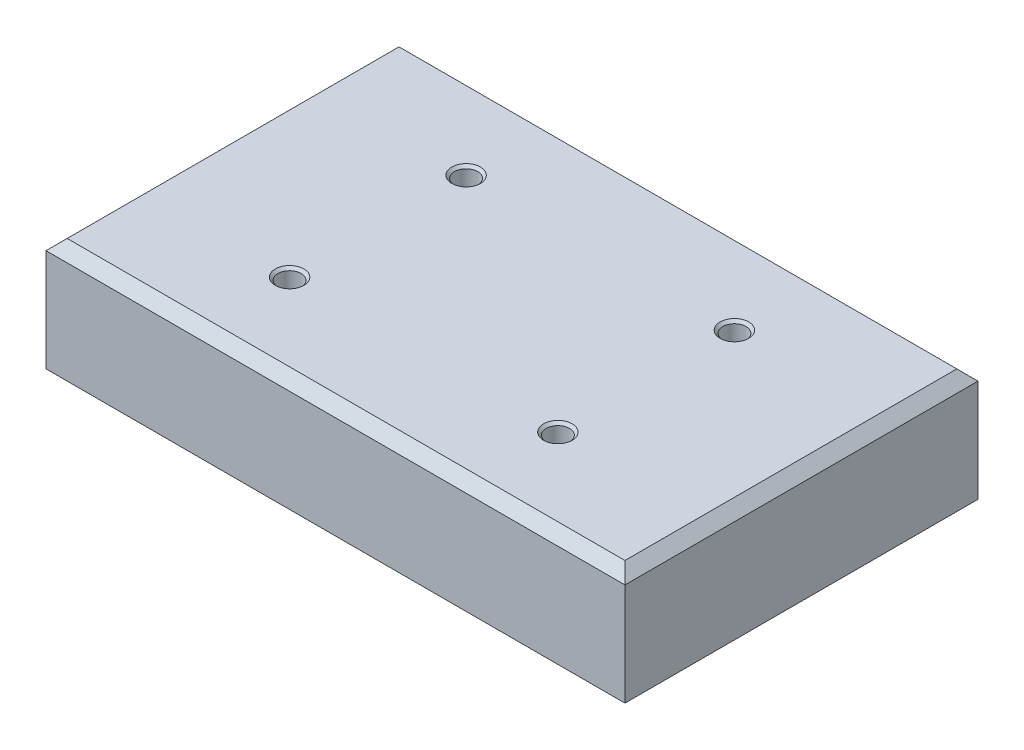
from build123d import *

# Parameters (mm, degrees)
SKETCH1_W                   = 82
SKETCH1_H                   = 50
BOSS_EXTRUDE1_DEPTH         = 16
M4_TAPPED_HOLE3_D           = 3.3
M4_TAPPED_HOLE3_DEPTH       = 8
M4_TAPPED_HOLE3_CSINK_D     = 4.05
M4_TAPPED_HOLE3_CSINK_ANGLE = 90
M4_TAPPED_HOLE3_TIP         = 0.991420021
CHAMFER1_SIZE               = 1.5
SKETCH7_W                   = 0.314102564
SKETCH7_H                   = 2.557692308
SKETCH7_H_2                 = 2.557692307
BOSS_EXTRUDE3_DEPTH         = 1


with BuildPart() as part:
    # Sketch1 → Boss-Extrude1 (new body)
    with BuildSketch(Plane(origin=(0, 0, 0), x_dir=(1, 0, 0), z_dir=(0, 1, 0))):
        Rectangle(SKETCH1_W, SKETCH1_H)
    extrude(amount=BOSS_EXTRUDE1_DEPTH)

    # M4 Tapped Hole3
    with Locations(Plane(origin=(0, 16, 0), x_dir=(1, 0, 0), z_dir=(0, 1, 0))):
        with Locations((-19, 12.5), (19, 12.5), (19, -12.5), (-19, -12.5)):
            CounterSinkHole(M4_TAPPED_HOLE3_D / 2, M4_TAPPED_HOLE3_CSINK_D / 2, depth=M4_TAPPED_HOLE3_DEPTH, counter_sink_angle=M4_TAPPED_HOLE3_CSINK_ANGLE)
            with Locations((0, 0, -(M4_TAPPED_HOLE3_DEPTH + M4_TAPPED_HOLE3_TIP / 2))):  # 118° drill point
                Cone(0, M4_TAPPED_HOLE3_D / 2, M4_TAPPED_HOLE3_TIP, mode=Mode.SUBTRACT)

    # Chamfer1
    chamfer1_edges = [part.edges().sort_by_distance(p)[0] for p in [
        (-41, 16, 0),
        (0, 16, 25),
        (41, 16, 0),
        (0, 16, -25),
    ]]
    chamfer(chamfer1_edges, length=CHAMFER1_SIZE)

    # Sketch7 → Boss-Extrude3 (add)
    # profile 1 of 21: a face of its own
    with BuildSketch(Plane(origin=(0, 0, -25), x_dir=(-1, 0, 0), z_dir=(0, 0, -1))):
        with BuildLine():
            Line((-28.712545327, 9.38912048), (-28.712545327, 12.88912048))
            Line((-28.712545327, 12.88912048), (-28.005814557, 12.88912048))
            add(Edge.make_bspline(
                [(-28.005814557, 12.88912048), (-27.944345569, 12.88867791), (-27.825587804, 12.887822867), (-27.653975357, 12.882401476), (-27.495191594, 12.87281101), (-27.349758735, 12.858841484), (-27.217277523, 12.84168845), (-27.098118915, 12.820188046), (-26.991666772, 12.794799876), (-26.926197331, 12.773154425), (-26.895237634, 12.762918557)],
                knots=[0, 0, 0, 0, 1.314313732, 2.53924729, 3.670748893, 4.714932338, 5.66265055, 6.526160246, 7.303039223, 8, 8, 8, 8], degree=3))
            add(Edge.make_bspline(
                [(-26.895237634, 12.762918557), (-26.854742895, 12.747487851), (-26.774671703, 12.716976357), (-26.66066458, 12.659420056), (-26.553339217, 12.594206954), (-26.452120072, 12.521251091), (-26.359319246, 12.438486743), (-26.271311349, 12.349429657), (-26.191696625, 12.250841317), (-26.118788329, 12.144766329), (-26.05305267, 12.032454277), (-25.995913512, 11.914119168), (-25.948459519, 11.79036196), (-25.909066292, 11.661526812), (-25.878019835, 11.527330434), (-25.856837903, 11.387616568), (-25.842866913, 11.242937379), (-25.841462862, 11.144762915), (-25.840750455, 11.094949807)],
                knots=[0, 0, 0, 0, 0.984719456, 1.947108742, 2.898477687, 3.838006223, 4.779231079, 5.722358779, 6.681677486, 7.655904652, 8.64651281, 9.637519902, 10.640069247, 11.656948941, 12.698408672, 13.768548281, 14.867775369, 16, 16, 16, 16], degree=3))
            add(Edge.make_bspline(
                [(-25.840750455, 11.094949807), (-25.841379422, 11.051688568), (-25.842618869, 10.96643778), (-25.853748184, 10.840796884), (-25.869924504, 10.718883313), (-25.894968702, 10.601277613), (-25.925371216, 10.486949395), (-25.964335367, 10.37711715), (-26.008970863, 10.270773341), (-26.061020742, 10.169355865), (-26.118162127, 10.073272493), (-26.17948387, 9.982696965), (-26.244920565, 9.898921743), (-26.315096198, 9.821693131), (-26.389103915, 9.751127552), (-26.467428245, 9.686635537), (-26.550271296, 9.629478982), (-26.637262019, 9.577411874), (-26.730938148, 9.531991518), (-26.833074014, 9.493561509), (-26.944105192, 9.461714893), (-27.063759149, 9.435143997), (-27.192242627, 9.414066695), (-27.329681593, 9.399940302), (-27.475864882, 9.39038737), (-27.576244148, 9.389550976), (-27.62790991, 9.38912048)],
                knots=[0, 0, 0, 0, 1.105936401, 2.179363191, 3.223086493, 4.248585256, 5.251745608, 6.245858792, 7.225916811, 8.198733463, 9.158002045, 10.082870192, 10.993790845, 11.873723703, 12.748670949, 13.606408763, 14.465103618, 15.319838547, 16.196477973, 17.123216899, 18.106603292, 19.147568657, 20.255746949, 21.433717677, 22.679120308, 24, 24, 24, 24], degree=3))
            Line((-27.62790991, 9.38912048), (-28.712545327, 9.38912048))
        make_face()
        with BuildLine():
            Line((-28.398442763, 9.748094839), (-27.996699974, 9.748094839))
            add(Edge.make_bspline(
                [(-27.996699974, 9.748094839), (-27.938971603, 9.748342935), (-27.827938805, 9.748820116), (-27.668280808, 9.753007319), (-27.522401411, 9.759849256), (-27.390279902, 9.769424334), (-27.271990878, 9.782092949), (-27.167287128, 9.796217852), (-27.076511869, 9.813815303), (-27.021582432, 9.829766262), (-26.996199173, 9.837137307)],
                knots=[0, 0, 0, 0, 1.375205317, 2.645023457, 3.804390687, 4.853969522, 5.800190428, 6.637939096, 7.370582563, 8, 8, 8, 8], degree=3))
            add(Edge.make_bspline(
                [(-26.996199173, 9.837137307), (-26.964250811, 9.848388865), (-26.901117173, 9.870623238), (-26.810236087, 9.9111809), (-26.725479083, 9.959222969), (-26.645369057, 10.012625243), (-26.571042402, 10.073271245), (-26.501618286, 10.139842234), (-26.437236484, 10.212677009), (-26.378562176, 10.291685171), (-26.326053872, 10.376374966), (-26.280582643, 10.4659138), (-26.240731111, 10.55932061), (-26.209452519, 10.658029769), (-26.184936935, 10.761158827), (-26.167572247, 10.868715041), (-26.156757522, 10.980678323), (-26.155496074, 11.056830447), (-26.154853019, 11.095650929)],
                knots=[0, 0, 0, 0, 0.998632004, 1.973411704, 2.929992603, 3.868527914, 4.809262121, 5.754881198, 6.702106254, 7.672490631, 8.653608572, 9.636854334, 10.631411391, 11.644891563, 12.686317036, 13.754757253, 14.855430412, 16, 16, 16, 16], degree=3))
            add(Edge.make_bspline(
                [(-26.154853019, 11.095650929), (-26.155366306, 11.136584409), (-26.156374664, 11.216998593), (-26.169048974, 11.334989289), (-26.18757053, 11.448469939), (-26.214354216, 11.557448135), (-26.248485095, 11.662136487), (-26.291079737, 11.761955997), (-26.339746356, 11.857960866), (-26.397649693, 11.947935232), (-26.461065286, 12.033028341), (-26.531443165, 12.110983256), (-26.607665204, 12.181977557), (-26.688900053, 12.247116869), (-26.777437153, 12.303780545), (-26.871190843, 12.354467226), (-26.971536515, 12.397483118), (-27.04134921, 12.42036198), (-27.076828179, 12.43198907)],
                knots=[0, 0, 0, 0, 1.122418816, 2.205001699, 3.251619955, 4.274784885, 5.280384055, 6.268708349, 7.249350384, 8.229342522, 9.199999885, 10.157847722, 11.105861043, 12.055065948, 13.010012805, 13.98527497, 14.976112212, 16, 16, 16, 16], degree=3))
            add(Edge.make_bspline(
                [(-27.076828179, 12.43198907), (-27.106179326, 12.440105498), (-27.168587916, 12.45736325), (-27.27042738, 12.476188623), (-27.385042529, 12.492793122), (-27.512942231, 12.506851161), (-27.65398069, 12.516938482), (-27.808266378, 12.524509797), (-27.975865982, 12.52961643), (-28.092048516, 12.529965137), (-28.152349013, 12.530146121)],
                knots=[0, 0, 0, 0, 0.674548936, 1.434276114, 2.292660221, 3.240891867, 4.284742987, 5.42552168, 6.663806718, 8, 8, 8, 8], degree=3))
            Line((-28.152349013, 12.530146121), (-28.398442763, 12.530146121))
            Line((-28.398442763, 12.530146121), (-28.398442763, 9.748094839))
        make_face(mode=Mode.SUBTRACT)
    # profile 2 of 21: a face of its own
    with BuildSketch(Plane(origin=(0, 0, -25), x_dir=(-1, 0, 0), z_dir=(0, 0, -1))):
        with BuildLine():
            Line((-23.113386673, 10.196812788), (-22.834340199, 10.050278333))
            add(Edge.make_bspline(
                [(-22.834340199, 10.050278333), (-22.856576794, 10.010835001), (-22.899840402, 9.934093899), (-22.97424115, 9.828662038), (-23.052233223, 9.733814322), (-23.137337191, 9.652084668), (-23.22700687, 9.580833283), (-23.321739524, 9.518495458), (-23.422028342, 9.465376938), (-23.527878067, 9.42062441), (-23.640177618, 9.386214916), (-23.759199135, 9.361910695), (-23.88517063, 9.346887426), (-23.97151681, 9.345142286), (-24.015730423, 9.344248685)],
                knots=[0, 0, 0, 0, 1.120438281, 2.179929193, 3.190490725, 4.156257408, 5.095198341, 6.022838206, 6.959905092, 7.901321166, 8.864066838, 9.862729781, 10.905609505, 12, 12, 12, 12], degree=3))
            add(Edge.make_bspline(
                [(-24.015730423, 9.344248685), (-24.0648724, 9.345395861), (-24.160734162, 9.347633667), (-24.300273909, 9.366926132), (-24.431653328, 9.39839849), (-24.554865031, 9.442364032), (-24.669607284, 9.499791356), (-24.776108138, 9.569750838), (-24.874927664, 9.651883092), (-24.962951873, 9.746899536), (-25.042195756, 9.848581493), (-25.112121576, 9.954537378), (-25.170579007, 10.064500602), (-25.218131617, 10.177771126), (-25.256536482, 10.29363502), (-25.283303186, 10.413146487), (-25.298732934, 10.535982072), (-25.30109738, 10.619079407), (-25.302288916, 10.660955416)],
                knots=[0, 0, 0, 0, 1.145258523, 2.234067595, 3.276747158, 4.290159414, 5.277019952, 6.260822364, 7.254936242, 8.264827045, 9.274100331, 10.257902744, 11.220704747, 12.172965371, 13.118907548, 14.062713208, 15.023725156, 16, 16, 16, 16], degree=3))
            add(Edge.make_bspline(
                [(-25.302288916, 10.660955416), (-25.301229775, 10.700250246), (-25.299130697, 10.778127411), (-25.285899909, 10.893392956), (-25.262451616, 11.005421408), (-25.230275292, 11.114305856), (-25.188724046, 11.21986399), (-25.137891827, 11.322160054), (-25.077699449, 11.421085194), (-25.031226776, 11.483488327), (-25.007817763, 11.514921762)],
                knots=[0, 0, 0, 0, 1.024358464, 2.0301432, 3.019427413, 4.004406732, 4.986367066, 5.972626655, 6.978780325, 8, 8, 8, 8], degree=3))
            add(Edge.make_bspline(
                [(-25.007817763, 11.514921762), (-24.97611008, 11.552790632), (-24.913699133, 11.627328783), (-24.808142778, 11.725267108), (-24.693842582, 11.807310884), (-24.572230955, 11.87531802), (-24.441894481, 11.926991667), (-24.30458519, 11.965499249), (-24.158739604, 11.98707726), (-24.059034383, 11.990125094), (-24.008018083, 11.991684583)],
                knots=[0, 0, 0, 0, 1.030682036, 2.02871468, 2.997146059, 3.962720338, 4.930598197, 5.918074684, 6.934738563, 8, 8, 8, 8], degree=3))
            add(Edge.make_bspline(
                [(-24.008018083, 11.991684583), (-23.955570478, 11.990330534), (-23.852680232, 11.987674198), (-23.702648111, 11.963047865), (-23.560687394, 11.92399531), (-23.42685489, 11.86884152), (-23.301137029, 11.797681968), (-23.18435098, 11.709540127), (-23.074499467, 11.607122039), (-23.010590888, 11.52835883), (-22.978070166, 11.488279134)],
                knots=[0, 0, 0, 0, 1.056321875, 2.072262726, 3.055038591, 4.01806755, 4.982017516, 5.957941055, 6.960871419, 8, 8, 8, 8], degree=3))
            add(Edge.make_bspline(
                [(-22.978070166, 11.488279134), (-22.955943228, 11.458075553), (-22.911836635, 11.397869434), (-22.856589535, 11.299698277), (-22.80863214, 11.196987682), (-22.770299179, 11.088077385), (-22.739259678, 10.974257805), (-22.716802859, 10.85471526), (-22.703633241, 10.729485349), (-22.701044543, 10.644158794), (-22.699724814, 10.600658942)],
                knots=[0, 0, 0, 0, 0.94817472, 1.890038105, 2.849395472, 3.817997239, 4.812318967, 5.836947057, 6.897266129, 8, 8, 8, 8], degree=3))
            Line((-22.699724814, 10.600658942), (-24.988186352, 10.600658942))
            add(Edge.make_bspline(
                [(-24.988186352, 10.600658942), (-24.986646746, 10.566958477), (-24.983619172, 10.500687874), (-24.969504029, 10.403717091), (-24.947255255, 10.311343748), (-24.915986192, 10.224260706), (-24.878119347, 10.141330579), (-24.83173363, 10.063168542), (-24.776394076, 9.990130612), (-24.714668377, 9.921563474), (-24.645961282, 9.860502713), (-24.573678534, 9.805850937), (-24.496784969, 9.76004534), (-24.415886886, 9.72286545), (-24.331115101, 9.693759134), (-24.242442906, 9.673891314), (-24.150044789, 9.660584207), (-24.087059055, 9.659104542), (-24.054993243, 9.658351249)],
                knots=[0, 0, 0, 0, 1.094153842, 2.151609401, 3.174256925, 4.172055639, 5.149267565, 6.128595816, 7.11444997, 8.118368179, 9.117203808, 10.09244225, 11.054858984, 12.015122123, 12.976791628, 13.957293641, 14.960065497, 16, 16, 16, 16], degree=3))
            add(Edge.make_bspline(
                [(-24.054993243, 9.658351249), (-24.023642096, 9.658959306), (-23.961435405, 9.660165807), (-23.868794548, 9.671897718), (-23.77765502, 9.690867994), (-23.688394037, 9.716757984), (-23.602823191, 9.748334836), (-23.523577641, 9.786437693), (-23.450697425, 9.82858744), (-23.382580459, 9.876797115), (-23.316509465, 9.935805302), (-23.250966979, 10.009441023), (-23.180690326, 10.096528551), (-23.136700733, 10.162074217), (-23.113386673, 10.196812788)],
                knots=[0, 0, 0, 0, 0.99110716, 1.966546729, 2.947904876, 3.932708344, 4.903319531, 5.828989031, 6.710028674, 7.56322171, 8.463672341, 9.504779593, 10.677557249, 12, 12, 12, 12], degree=3))
        make_face()
        with BuildLine():
            add(Edge.make_bspline(
                [(-23.013827378, 10.914761506), (-23.025324003, 10.956424379), (-23.047451304, 11.036612), (-23.093687668, 11.14765289), (-23.145759209, 11.246340791), (-23.207380941, 11.331920425), (-23.277199666, 11.407923937), (-23.357844849, 11.474342523), (-23.448280742, 11.533759974), (-23.548039883, 11.583912473), (-23.653681668, 11.626602332), (-23.76428786, 11.655227448), (-23.877145648, 11.67483699), (-23.953479934, 11.676663098), (-23.991892282, 11.677582019)],
                knots=[0, 0, 0, 0, 1.154881502, 2.222775134, 3.210006277, 4.132804581, 5.035138423, 5.962687519, 6.919655026, 7.923214229, 8.944639381, 9.960483929, 10.97369054, 12, 12, 12, 12], degree=3))
            add(Edge.make_bspline(
                [(-23.991892282, 11.677582019), (-24.02324172, 11.676970347), (-24.085212969, 11.675761201), (-24.176514038, 11.664291072), (-24.264193737, 11.645331227), (-24.348899024, 11.61936627), (-24.429519893, 11.584757668), (-24.507714661, 11.544174441), (-24.581495057, 11.494632857), (-24.627636352, 11.456874002), (-24.650946769, 11.437798365)],
                knots=[0, 0, 0, 0, 1.04873581, 2.073130211, 3.073294108, 4.04793562, 5.032784715, 6.005352987, 6.992311501, 8, 8, 8, 8], degree=3))
            add(Edge.make_bspline(
                [(-24.650946769, 11.437798365), (-24.667640051, 11.422704049), (-24.701423185, 11.392156833), (-24.746563707, 11.339527626), (-24.789784179, 11.282776064), (-24.829117832, 11.21973094), (-24.865195419, 11.151110161), (-24.898955396, 11.077492525), (-24.929341808, 10.998319395), (-24.946437918, 10.943146956), (-24.955233628, 10.914761506)],
                knots=[0, 0, 0, 0, 0.879870761, 1.780643979, 2.707998968, 3.669668524, 4.684282772, 5.740141944, 6.837334558, 8, 8, 8, 8], degree=3))
            Line((-24.955233628, 10.914761506), (-23.013827378, 10.914761506))
        make_face(mode=Mode.SUBTRACT)
    # profile 3 of 21: a face of its own
    with BuildSketch(Plane(origin=(0, 0, -25), x_dir=(-1, 0, 0), z_dir=(0, 0, -1))):
        with BuildLine():
            Line((-20.859981224, 11.627802371), (-21.07312225, 11.408351249))
            add(Edge.make_bspline(
                [(-21.07312225, 11.408351249), (-21.091512753, 11.429664396), (-21.126967479, 11.470753633), (-21.18319896, 11.525690699), (-21.239222564, 11.571827638), (-21.294271377, 11.610779897), (-21.349729646, 11.640229044), (-21.404946564, 11.661723906), (-21.459979303, 11.675025711), (-21.496765338, 11.67674015), (-21.514828981, 11.677582019)],
                knots=[0, 0, 0, 0, 1.26578478, 2.440284043, 3.530471711, 4.527705817, 5.468200915, 6.346673037, 7.188140097, 8, 8, 8, 8], degree=3))
            add(Edge.make_bspline(
                [(-21.514828981, 11.677582019), (-21.53696837, 11.676507146), (-21.580535556, 11.674391948), (-21.642961375, 11.653278517), (-21.700912, 11.620869779), (-21.75106898, 11.574901195), (-21.79355666, 11.522136926), (-21.824570341, 11.463140602), (-21.843536324, 11.399692558), (-21.845941056, 11.3556627), (-21.847160711, 11.333331217)],
                knots=[0, 0, 0, 0, 0.99966794, 1.967205029, 2.953328237, 3.988086729, 5.028030931, 6.008226631, 6.989793394, 8, 8, 8, 8], degree=3))
            add(Edge.make_bspline(
                [(-21.847160711, 11.333331217), (-21.846049899, 11.313119173), (-21.843831406, 11.272752062), (-21.826584727, 11.213204028), (-21.799118655, 11.15514699), (-21.77344846, 11.119584084), (-21.760221609, 11.101259903)],
                knots=[0, 0, 0, 0, 0.960159726, 1.917612774, 2.927026955, 4, 4, 4, 4], degree=3))
            add(Edge.make_bspline(
                [(-21.760221609, 11.101259903), (-21.752258115, 11.091475319), (-21.735308822, 11.070650064), (-21.703500307, 11.041746211), (-21.667477804, 11.00980396), (-21.624157867, 10.977867123), (-21.575406839, 10.944235398), (-21.520167555, 10.910233265), (-21.46019305, 10.87326884), (-21.417255743, 10.849824404), (-21.394937154, 10.837638108)],
                knots=[0, 0, 0, 0, 0.66740084, 1.420478572, 2.27185888, 3.217733974, 4.268547843, 5.408967954, 6.65319498, 8, 8, 8, 8], degree=3))
            add(Edge.make_bspline(
                [(-21.394937154, 10.837638108), (-21.367723577, 10.822393205), (-21.315155906, 10.792945073), (-21.240463139, 10.74723537), (-21.172676098, 10.701803945), (-21.111220431, 10.657136671), (-21.057278622, 10.611983804), (-21.009214069, 10.568076047), (-20.968225625, 10.524086739), (-20.945271699, 10.493353625), (-20.934300134, 10.478663749)],
                knots=[0, 0, 0, 0, 1.27191281, 2.456916733, 3.569705269, 4.599008579, 5.553216877, 6.436649441, 7.252746552, 8, 8, 8, 8], degree=3))
            add(Edge.make_bspline(
                [(-20.934300134, 10.478663749), (-20.916089607, 10.448997661), (-20.879847278, 10.38995664), (-20.841789011, 10.292738213), (-20.819728736, 10.18962771), (-20.816666516, 10.11909549), (-20.815109429, 10.083231057)],
                knots=[0, 0, 0, 0, 0.995354457, 1.980940102, 2.973342416, 4, 4, 4, 4], degree=3))
            add(Edge.make_bspline(
                [(-20.815109429, 10.083231057), (-20.815828963, 10.057961911), (-20.817246883, 10.008166298), (-20.82710495, 9.934831468), (-20.844059926, 9.86469691), (-20.86715368, 9.797001626), (-20.898338053, 9.733042686), (-20.93488585, 9.671206437), (-20.978760762, 9.612830506), (-21.028852138, 9.557991546), (-21.083697632, 9.507905799), (-21.14220377, 9.463881845), (-21.204442601, 9.427307508), (-21.269969402, 9.397042162), (-21.338933056, 9.372973904), (-21.411344345, 9.356311373), (-21.4869731, 9.346338612), (-21.538402908, 9.344954136), (-21.564608628, 9.344248685)],
                knots=[0, 0, 0, 0, 1.032770009, 2.035186124, 3.017557409, 3.978232242, 4.952395191, 5.920591857, 6.910227898, 7.931268572, 8.952309245, 9.941945286, 10.918353717, 11.897095711, 12.887975737, 13.898235213, 14.929059601, 16, 16, 16, 16], degree=3))
            add(Edge.make_bspline(
                [(-21.564608628, 9.344248685), (-21.599975803, 9.345241386), (-21.67021873, 9.347212993), (-21.77410845, 9.365719054), (-21.875629208, 9.394514448), (-21.974012748, 9.434230382), (-22.067058862, 9.484381095), (-22.152189787, 9.544443488), (-22.229701249, 9.612433486), (-22.273819523, 9.664546396), (-22.29587866, 9.690602852)],
                knots=[0, 0, 0, 0, 1.013940152, 2.01379169, 3.017749504, 4.037548394, 5.051665909, 6.043208538, 7.021604269, 8, 8, 8, 8], degree=3))
            Line((-22.29587866, 9.690602852), (-22.087645487, 9.927582019))
            add(Edge.make_bspline(
                [(-22.087645487, 9.927582019), (-22.067873074, 9.906227254), (-22.029541262, 9.864827814), (-21.968240045, 9.809703473), (-21.905860644, 9.763502202), (-21.843025957, 9.724858787), (-21.778805863, 9.695083384), (-21.713560249, 9.67416479), (-21.647421825, 9.660720598), (-21.602999689, 9.659142316), (-21.580734429, 9.658351249)],
                knots=[0, 0, 0, 0, 1.179806542, 2.287233372, 3.337373186, 4.324005949, 5.273901747, 6.200048787, 7.097828587, 8, 8, 8, 8], degree=3))
            add(Edge.make_bspline(
                [(-21.580734429, 9.658351249), (-21.550416503, 9.659722074), (-21.491180362, 9.662400436), (-21.406336603, 9.686717528), (-21.327997977, 9.72484748), (-21.259974631, 9.778932178), (-21.20207247, 9.841887751), (-21.160144296, 9.91280187), (-21.13386812, 9.989593327), (-21.130782122, 10.042825629), (-21.129211993, 10.069909743)],
                knots=[0, 0, 0, 0, 1.072336372, 2.095165389, 3.102688358, 4.141489647, 5.156069229, 6.117746104, 7.042326257, 8, 8, 8, 8], degree=3))
            add(Edge.make_bspline(
                [(-21.129211993, 10.069909743), (-21.130298288, 10.092219362), (-21.13244303, 10.136266717), (-21.149286302, 10.200017058), (-21.175899155, 10.260486339), (-21.202103803, 10.295875986), (-21.215449974, 10.313900127)],
                knots=[0, 0, 0, 0, 1.013901739, 2.00181326, 2.98231254, 4, 4, 4, 4], degree=3))
            add(Edge.make_bspline(
                [(-21.215449974, 10.313900127), (-21.223472369, 10.32293549), (-21.240948041, 10.342617772), (-21.273003282, 10.371042851), (-21.311385145, 10.40168095), (-21.356525307, 10.434012539), (-21.408514769, 10.467611144), (-21.467564245, 10.502300496), (-21.532864797, 10.539728222), (-21.579035429, 10.564547877), (-21.603170327, 10.577521922)],
                knots=[0, 0, 0, 0, 0.615000592, 1.339693406, 2.178160186, 3.116406724, 4.166410947, 5.330106347, 6.604359322, 8, 8, 8, 8], degree=3))
            add(Edge.make_bspline(
                [(-21.603170327, 10.577521922), (-21.629216967, 10.592061054), (-21.679729714, 10.62025707), (-21.751277005, 10.664173151), (-21.815824359, 10.708840425), (-21.874924934, 10.751753264), (-21.92708594, 10.795174208), (-21.972101888, 10.83915146), (-22.011745104, 10.881911446), (-22.033692516, 10.912208743), (-22.044175936, 10.926680576)],
                knots=[0, 0, 0, 0, 1.262093308, 2.447601706, 3.550203992, 4.582594899, 5.537233252, 6.418365656, 7.244515135, 8, 8, 8, 8], degree=3))
            add(Edge.make_bspline(
                [(-22.044175936, 10.926680576), (-22.062306535, 10.955826191), (-22.098574071, 11.014127607), (-22.133789262, 11.111438083), (-22.157995291, 11.213883141), (-22.160157681, 11.284569995), (-22.161263275, 11.320711025)],
                knots=[0, 0, 0, 0, 0.985009483, 1.970363186, 2.962279964, 4, 4, 4, 4], degree=3))
            add(Edge.make_bspline(
                [(-22.161263275, 11.320711025), (-22.16072908, 11.344336423), (-22.159683584, 11.390574674), (-22.151339533, 11.458513494), (-22.136147821, 11.523061648), (-22.117092899, 11.585188511), (-22.090609894, 11.643690605), (-22.058963989, 11.699348076), (-22.021776564, 11.752083994), (-21.978933273, 11.801087126), (-21.931826628, 11.845596452), (-21.880931858, 11.88439508), (-21.827393602, 11.917501435), (-21.770985182, 11.945266596), (-21.711164709, 11.966267978), (-21.648350323, 11.980725364), (-21.582669168, 11.990380566), (-21.537768042, 11.991243651), (-21.514828981, 11.991684583)],
                knots=[0, 0, 0, 0, 1.087655834, 2.128696564, 3.144119009, 4.137814668, 5.115653402, 6.093965665, 7.082169637, 8.081268856, 9.086088321, 10.061021666, 11.022561449, 11.980240094, 12.950172527, 13.934149372, 14.944599409, 16, 16, 16, 16], degree=3))
            add(Edge.make_bspline(
                [(-21.514828981, 11.991684583), (-21.487636917, 11.990580242), (-21.432742695, 11.988350844), (-21.350388069, 11.970645154), (-21.268154727, 11.94151205), (-21.185831377, 11.901275816), (-21.104021088, 11.84920894), (-21.022004231, 11.786279641), (-20.938796201, 11.712901926), (-20.886839888, 11.656802701), (-20.859981224, 11.627802371)],
                knots=[0, 0, 0, 0, 0.845714091, 1.707292901, 2.609013841, 3.555613372, 4.552488639, 5.621697636, 6.770543573, 8, 8, 8, 8], degree=3))
        make_face()
    # profile 4 of 21: a face of its own
    with BuildSketch(Plane(origin=(0, 0, -25), x_dir=(-1, 0, 0), z_dir=(0, 0, -1))):
        with BuildLine():
            add(Edge.make_bspline(
                [(-20.076127057, 13.023735865), (-20.056635742, 13.022831712), (-20.018468002, 13.021061208), (-19.963274734, 13.005899731), (-19.913017722, 12.980200046), (-19.868439989, 12.945720365), (-19.830188103, 12.905170921), (-19.803407392, 12.857909953), (-19.786194996, 12.806851314), (-19.784116441, 12.771236225), (-19.783058147, 12.753102852)],
                knots=[0, 0, 0, 0, 1.055194115, 2.066272739, 3.074728998, 4.095836921, 5.109056067, 6.073838105, 7.019297344, 8, 8, 8, 8], degree=3))
            add(Edge.make_bspline(
                [(-19.783058147, 12.753102852), (-19.784140307, 12.735440199), (-19.786279609, 12.700523224), (-19.803394097, 12.650349752), (-19.830416335, 12.603745468), (-19.868415461, 12.563274758), (-19.913024222, 12.528814138), (-19.963273008, 12.503109399), (-20.018468456, 12.487949262), (-20.056635895, 12.486178573), (-20.076127057, 12.485274326)],
                knots=[0, 0, 0, 0, 0.96129708, 1.900370562, 2.859976407, 3.87933698, 4.906634145, 5.921202961, 6.938410037, 8, 8, 8, 8], degree=3))
            add(Edge.make_bspline(
                [(-20.076127057, 12.485274326), (-20.095395333, 12.486144046), (-20.132898513, 12.487836843), (-20.187265355, 12.503406861), (-20.237093845, 12.528822934), (-20.281758517, 12.563049119), (-20.31898871, 12.603994016), (-20.346087036, 12.65032131), (-20.363161998, 12.700530465), (-20.365306626, 12.735442631), (-20.366391481, 12.753102852)],
                knots=[0, 0, 0, 0, 1.054934014, 2.053291228, 3.073705704, 4.106921865, 5.123545215, 6.088680038, 7.033164197, 8, 8, 8, 8], degree=3))
            add(Edge.make_bspline(
                [(-20.366391481, 12.753102852), (-20.365330394, 12.771233701), (-20.363246353, 12.806843834), (-20.346074237, 12.857938867), (-20.319214429, 12.904920369), (-20.281733865, 12.945945868), (-20.237100405, 12.980191303), (-20.18726366, 13.005602284), (-20.132898961, 13.021173624), (-20.095395485, 13.022866238), (-20.076127057, 13.023735865)],
                knots=[0, 0, 0, 0, 0.98631895, 1.937192651, 2.907499808, 3.917963147, 4.944918757, 5.95915025, 6.951458133, 8, 8, 8, 8], degree=3))
        make_face()
    # profile 5 of 21: a face of its own
    with BuildSketch(Plane(origin=(0, 0, -25), x_dir=(-1, 0, 0), z_dir=(0, 0, -1))):
        with Locations((-20.074724814, 10.667966634)):
            Rectangle(SKETCH7_W, SKETCH7_H)
    # profile 6 of 21: a face of its own
    with BuildSketch(Plane(origin=(0, 0, -25), x_dir=(-1, 0, 0), z_dir=(0, 0, -1))):
        with BuildLine():
            Line((-16.911263275, 11.946812788), (-16.597160711, 11.946812788))
            Line((-16.597160711, 11.946812788), (-16.597160711, 9.917065192))
            add(Edge.make_bspline(
                [(-16.597160711, 9.917065192), (-16.597437754, 9.873827597), (-16.597972513, 9.790368624), (-16.601823484, 9.669690345), (-16.609944161, 9.558224259), (-16.619152843, 9.455462001), (-16.632399559, 9.36187989), (-16.648575926, 9.277198686), (-16.666811605, 9.201337123), (-16.682831823, 9.154612282), (-16.69040991, 9.132509903)],
                knots=[0, 0, 0, 0, 1.307562039, 2.523909702, 3.650326591, 4.686913197, 5.643429486, 6.506965704, 7.293745905, 8, 8, 8, 8], degree=3))
            add(Edge.make_bspline(
                [(-16.69040991, 9.132509903), (-16.701599149, 9.103779982), (-16.723643075, 9.047179144), (-16.764928709, 8.966944824), (-16.811162612, 8.891398434), (-16.863969363, 8.820960983), (-16.923110167, 8.75598607), (-16.987191659, 8.695062071), (-17.057461851, 8.639477904), (-17.133880563, 8.590192606), (-17.214686196, 8.545805552), (-17.299832298, 8.507358985), (-17.388838736, 8.473872141), (-17.482541628, 8.448789345), (-17.579471862, 8.427054625), (-17.680769294, 8.412909939), (-17.78584209, 8.403282881), (-17.85728747, 8.402392648), (-17.89353491, 8.401940993)],
                knots=[0, 0, 0, 0, 0.981931301, 1.934503488, 2.87077864, 3.801706999, 4.735015492, 5.667491629, 6.616593066, 7.585388521, 8.561939025, 9.551802639, 10.560317337, 11.588439944, 12.640189604, 13.723962949, 14.845264515, 16, 16, 16, 16], degree=3))
            add(Edge.make_bspline(
                [(-17.89353491, 8.401940993), (-17.946419645, 8.402797479), (-18.04971774, 8.404470426), (-18.200322733, 8.423961341), (-18.343357452, 8.451515714), (-18.476931909, 8.493221141), (-18.600202006, 8.544258131), (-18.712325882, 8.602853084), (-18.812296989, 8.670042393), (-18.902420662, 8.746542994), (-18.983762252, 8.837506675), (-19.060289542, 8.94470552), (-19.133950484, 9.069772409), (-19.177119122, 9.161565122), (-19.199724814, 9.209633301)],
                knots=[0, 0, 0, 0, 1.157897085, 2.2616841, 3.32207898, 4.345638746, 5.321241055, 6.241986252, 7.112515963, 7.955008012, 8.825025602, 9.77857164, 10.836726669, 12, 12, 12, 12], degree=3))
            Line((-19.199724814, 9.209633301), (-18.88562225, 9.209633301))
            add(Edge.make_bspline(
                [(-18.88562225, 9.209633301), (-18.86036004, 9.169527425), (-18.810975532, 9.091125376), (-18.718627051, 8.98961222), (-18.617420725, 8.902858856), (-18.503941042, 8.832948082), (-18.377715826, 8.78023829), (-18.23866914, 8.742662994), (-18.085669518, 8.720166727), (-17.979151304, 8.717455433), (-17.923683147, 8.716043557)],
                knots=[0, 0, 0, 0, 0.997731894, 1.950442991, 2.880492273, 3.800895997, 4.748200782, 5.754801363, 6.83083817, 8, 8, 8, 8], degree=3))
            add(Edge.make_bspline(
                [(-17.923683147, 8.716043557), (-17.868916257, 8.717473706), (-17.763331174, 8.720230889), (-17.611500005, 8.742673034), (-17.472905067, 8.780246467), (-17.348344866, 8.832854854), (-17.239289098, 8.89730526), (-17.145277107, 8.969305335), (-17.069132431, 9.050486338), (-17.017919464, 9.125268144), (-16.986084846, 9.191892273), (-16.965812609, 9.249244869), (-16.94933864, 9.314097747), (-16.935558803, 9.386233483), (-16.924187889, 9.46575514), (-16.916985007, 9.552844544), (-16.911779195, 9.647303766), (-16.911439225, 9.712796904), (-16.911263275, 9.746692595)],
                knots=[0, 0, 0, 0, 1.570740765, 3.028230971, 4.391408896, 5.680370741, 6.894727393, 8.017376726, 9.065722033, 10.075533815, 10.603371122, 11.180248986, 11.817768598, 12.521299649, 13.286540596, 14.121245857, 15.027658897, 16, 16, 16, 16], degree=3))
            Line((-16.911263275, 9.746692595), (-16.911263275, 9.879204615))
            add(Edge.make_bspline(
                [(-16.911263275, 9.879204615), (-16.943144393, 9.841262813), (-17.006345849, 9.766046593), (-17.115493176, 9.667484956), (-17.234710091, 9.582598826), (-17.363793634, 9.512980191), (-17.499581876, 9.457298767), (-17.640604106, 9.418355806), (-17.785596162, 9.393195906), (-17.883848311, 9.39048859), (-17.933498852, 9.38912048)],
                knots=[0, 0, 0, 0, 1.012485704, 2.007162095, 2.997754123, 3.998611389, 4.999708251, 5.992315798, 6.98544096, 8, 8, 8, 8], degree=3))
            add(Edge.make_bspline(
                [(-17.933498852, 9.38912048), (-17.962735122, 9.389635507), (-18.020861679, 9.390659465), (-18.107216427, 9.399618242), (-18.192296865, 9.412616984), (-18.275904569, 9.431698423), (-18.358160182, 9.45619015), (-18.438927774, 9.486806889), (-18.5188613, 9.521422007), (-18.596507798, 9.56219481), (-18.671093929, 9.607557117), (-18.742057114, 9.656696008), (-18.809025653, 9.709354296), (-18.871362143, 9.766051236), (-18.928984814, 9.826704769), (-18.982668682, 9.890668322), (-19.031526029, 9.958835063), (-19.076559418, 10.029962021), (-19.115616969, 10.104522944), (-19.149901341, 10.18090104), (-19.179710746, 10.258932994), (-19.203476147, 10.338880057), (-19.221627261, 10.420691826), (-19.235137488, 10.504234275), (-19.242800419, 10.589764662), (-19.243995343, 10.647386012), (-19.244596609, 10.676380095)],
                knots=[0, 0, 0, 0, 1.028754217, 2.045334182, 3.052854819, 4.056607503, 5.061168794, 6.071104265, 7.095078842, 8.125279047, 9.155117945, 10.165957491, 11.161587969, 12.151493252, 13.128948131, 14.104219989, 15.088194871, 16.07871515, 17.064853787, 18.047899887, 19.02414258, 20.002704429, 20.980574569, 21.971845993, 22.979467364, 24, 24, 24, 24], degree=3))
            add(Edge.make_bspline(
                [(-19.244596609, 10.676380095), (-19.244077442, 10.705383191), (-19.243041121, 10.76327705), (-19.234090141, 10.849156436), (-19.221321952, 10.933885871), (-19.201114183, 11.016592013), (-19.17679166, 11.098216764), (-19.146668088, 11.178157221), (-19.110449329, 11.25643773), (-19.069439579, 11.333116261), (-19.023355486, 11.407163876), (-18.972823005, 11.477490522), (-18.917781131, 11.543578694), (-18.858989216, 11.606095116), (-18.795729399, 11.664436609), (-18.728034406, 11.718461574), (-18.656571526, 11.7690756), (-18.581119276, 11.815186937), (-18.502841887, 11.855969184), (-18.42372807, 11.893181781), (-18.342729835, 11.9227159), (-18.261357295, 11.948738999), (-18.17817738, 11.967174195), (-18.094209987, 11.981396437), (-18.009167649, 11.990061158), (-17.952214754, 11.991142743), (-17.923683147, 11.991684583)],
                knots=[0, 0, 0, 0, 1.008818848, 2.013730394, 3.001654427, 3.987803273, 4.973046549, 5.963777569, 6.957074694, 7.972068341, 8.987420212, 9.989399531, 10.982630087, 11.977756091, 12.973280677, 13.973972381, 14.989194003, 16.018387222, 17.047741039, 18.059210846, 19.057554164, 20.045176975, 21.029480261, 22.018708529, 23.007435371, 24, 24, 24, 24], degree=3))
            add(Edge.make_bspline(
                [(-17.923683147, 11.991684583), (-17.876632208, 11.990327909), (-17.783721061, 11.987648896), (-17.646990059, 11.966627751), (-17.515047819, 11.933113738), (-17.387149803, 11.885098107), (-17.262254152, 11.819548069), (-17.140772497, 11.733205121), (-17.022353362, 11.625294781), (-16.949275532, 11.542541917), (-16.911263275, 11.499497083)],
                knots=[0, 0, 0, 0, 0.96728863, 1.910097829, 2.838038873, 3.762875196, 4.71315279, 5.730631239, 6.819562287, 8, 8, 8, 8], degree=3))
            Line((-16.911263275, 11.499497083), (-16.911263275, 11.946812788))
        make_face()
        with BuildLine():
            add(Edge.make_bspline(
                [(-17.898442763, 11.677582019), (-17.944373467, 11.676020953), (-18.035306521, 11.672930374), (-18.168594863, 11.646545661), (-18.297271797, 11.605199761), (-18.418877225, 11.546057146), (-18.532784335, 11.473962908), (-18.633859155, 11.38662262), (-18.722264071, 11.286876423), (-18.79704701, 11.175626176), (-18.856578376, 11.055603901), (-18.898721796, 10.929093167), (-18.925971819, 10.798138174), (-18.928979471, 10.708765571), (-18.930494045, 10.663759903)],
                knots=[0, 0, 0, 0, 1.026226791, 2.031711442, 3.026614839, 4.04107745, 5.047145931, 6.032893242, 7.017642609, 8.019221815, 9.021877557, 10.003543541, 10.994637589, 12, 12, 12, 12], degree=3))
            add(Edge.make_bspline(
                [(-18.930494045, 10.663759903), (-18.929768288, 10.629826631), (-18.928340936, 10.563089807), (-18.914617359, 10.465151912), (-18.892436394, 10.371871598), (-18.860999187, 10.283243224), (-18.822046492, 10.198758429), (-18.773054121, 10.118999194), (-18.71540315, 10.043894488), (-18.649544812, 9.973999806), (-18.57696843, 9.910338838), (-18.498249231, 9.854400797), (-18.413493981, 9.808650076), (-18.324787171, 9.769109239), (-18.229976415, 9.740230171), (-18.130427329, 9.718191392), (-18.025435632, 9.705582634), (-17.953863893, 9.704019836), (-17.917373051, 9.703223044)],
                knots=[0, 0, 0, 0, 1.039728707, 2.044842319, 3.024901384, 3.974314358, 4.923051295, 5.871625912, 6.837440708, 7.820715446, 8.810779094, 9.792721783, 10.773906224, 11.758876063, 12.764959493, 13.806266761, 14.881525401, 16, 16, 16, 16], degree=3))
            add(Edge.make_bspline(
                [(-17.917373051, 9.703223044), (-17.880409293, 9.703990653), (-17.808127055, 9.705491705), (-17.702556119, 9.718395203), (-17.602523379, 9.739217179), (-17.508120556, 9.768780205), (-17.418991215, 9.806501955), (-17.336136601, 9.854238573), (-17.257780153, 9.908603005), (-17.186423743, 9.972015019), (-17.121899577, 10.041900014), (-17.065668811, 10.117944909), (-17.017754362, 10.199005428), (-16.978076692, 10.285072434), (-16.947785488, 10.376814787), (-16.927466583, 10.474003143), (-16.913259837, 10.576171882), (-16.911938913, 10.646180498), (-16.911263275, 10.68198907)],
                knots=[0, 0, 0, 0, 1.121943988, 2.193949579, 3.223793937, 4.220241907, 5.192961521, 6.155822191, 7.11847367, 8.083710714, 9.04790392, 10.001595906, 10.949595423, 11.902125208, 12.873731292, 13.87582262, 14.913508608, 16, 16, 16, 16], degree=3))
            add(Edge.make_bspline(
                [(-16.911263275, 10.68198907), (-16.912602844, 10.728606924), (-16.915219889, 10.819681829), (-16.939917047, 10.952388597), (-16.979737257, 11.077157271), (-17.035584009, 11.193593246), (-17.105566018, 11.300462796), (-17.189856867, 11.395786641), (-17.287002897, 11.479687497), (-17.396724998, 11.549585691), (-17.514772443, 11.606051125), (-17.638293639, 11.648412897), (-17.767105203, 11.672407212), (-17.854411612, 11.675847156), (-17.898442763, 11.677582019)],
                knots=[0, 0, 0, 0, 1.070913519, 2.092188694, 3.091357305, 4.074328408, 5.051968682, 6.018948707, 6.99050112, 7.9935919, 9.000589572, 9.992915277, 10.987769056, 12, 12, 12, 12], degree=3))
        make_face(mode=Mode.SUBTRACT)
    # profile 7 of 21: a face of its own
    with BuildSketch(Plane(origin=(0, 0, -25), x_dir=(-1, 0, 0), z_dir=(0, 0, -1))):
        with BuildLine():
            Line((-15.879211993, 11.946812788), (-15.565109429, 11.946812788))
            Line((-15.565109429, 11.946812788), (-15.565109429, 11.485474647))
            add(Edge.make_bspline(
                [(-15.565109429, 11.485474647), (-15.531571794, 11.52731737), (-15.466490843, 11.608514633), (-15.35810651, 11.715235208), (-15.24356261, 11.803180433), (-15.123560606, 11.873284227), (-14.997937596, 11.926130853), (-14.867459326, 11.964296784), (-14.73134462, 11.987181612), (-14.638780183, 11.990171843), (-14.591952378, 11.991684583)],
                knots=[0, 0, 0, 0, 1.12780773, 2.188550248, 3.19190651, 4.159438251, 5.104880172, 6.052711206, 7.014878035, 8, 8, 8, 8], degree=3))
            add(Edge.make_bspline(
                [(-14.591952378, 11.991684583), (-14.544621744, 11.989939387), (-14.451984276, 11.986523619), (-14.317106215, 11.959506928), (-14.191132821, 11.913361672), (-14.074513265, 11.850149602), (-13.969386052, 11.771543129), (-13.8770612, 11.679965347), (-13.800697953, 11.574629264), (-13.74950059, 11.476906107), (-13.715774942, 11.390217313), (-13.694542605, 11.315970563), (-13.676511623, 11.233252412), (-13.660879875, 11.142312823), (-13.650302763, 11.042514633), (-13.641960472, 10.934266941), (-13.635981778, 10.81760481), (-13.635744571, 10.736918183), (-13.63562225, 10.695310384)],
                knots=[0, 0, 0, 0, 1.235846778, 2.418850247, 3.575807741, 4.728682307, 5.871620074, 6.994088408, 8.11269785, 9.256955736, 9.865816715, 10.540099792, 11.271859618, 12.076849838, 12.949306005, 13.892391288, 14.913166135, 16, 16, 16, 16], degree=3))
            Line((-13.63562225, 10.695310384), (-13.63562225, 9.38912048))
            Line((-13.63562225, 9.38912048), (-13.949724814, 9.38912048))
            Line((-13.949724814, 9.38912048), (-13.949724814, 10.59224548))
            add(Edge.make_bspline(
                [(-13.949724814, 10.59224548), (-13.949918022, 10.627067925), (-13.950287596, 10.693677336), (-13.951453243, 10.789046359), (-13.954263049, 10.875532937), (-13.958211362, 10.952930305), (-13.963990393, 11.021164141), (-13.970013024, 11.080373418), (-13.977378001, 11.13048296), (-13.983940914, 11.160648043), (-13.986884269, 11.17417657)],
                knots=[0, 0, 0, 0, 1.430800155, 2.736877192, 3.918605307, 4.986035426, 5.920637409, 6.731861385, 7.431261377, 8, 8, 8, 8], degree=3))
            add(Edge.make_bspline(
                [(-13.986884269, 11.17417657), (-13.997509801, 11.213887755), (-14.017960661, 11.290319499), (-14.068494644, 11.393993852), (-14.132308825, 11.48219204), (-14.210206674, 11.554368761), (-14.30143575, 11.610539598), (-14.405742893, 11.649513553), (-14.522121534, 11.673889822), (-14.603975916, 11.676316954), (-14.646639878, 11.677582019)],
                knots=[0, 0, 0, 0, 1.084156227, 2.086665306, 3.027808233, 3.945421172, 4.874247719, 5.839848303, 6.874090471, 8, 8, 8, 8], degree=3))
            add(Edge.make_bspline(
                [(-14.646639878, 11.677582019), (-14.671907562, 11.677106014), (-14.721911655, 11.676164013), (-14.796061627, 11.666712715), (-14.8679858, 11.651254259), (-14.938406009, 11.630385622), (-15.005913802, 11.601723353), (-15.072678094, 11.569193982), (-15.136184858, 11.52864577), (-15.197788255, 11.483455149), (-15.255101063, 11.433375942), (-15.308429401, 11.380531432), (-15.355967421, 11.324255828), (-15.399036096, 11.26545588), (-15.43621436, 11.203324042), (-15.468667448, 11.138459736), (-15.496203143, 11.070777587), (-15.509885835, 11.023802526), (-15.516732025, 11.000298365)],
                knots=[0, 0, 0, 0, 1.023777757, 2.026029729, 3.023749952, 4.003683103, 4.997618607, 5.993177895, 7.010360494, 8.046726602, 9.087585522, 10.09234134, 11.086953743, 12.070360549, 13.043493632, 14.017870808, 15.008233677, 16, 16, 16, 16], degree=3))
            add(Edge.make_bspline(
                [(-15.516732025, 11.000298365), (-15.520671674, 10.983043162), (-15.529248083, 10.945479487), (-15.538511263, 10.883835068), (-15.546918838, 10.812525093), (-15.553955797, 10.731632776), (-15.558261213, 10.640874901), (-15.56295561, 10.540639063), (-15.564664671, 10.430525574), (-15.564957025, 10.353863882), (-15.565109429, 10.313900127)],
                knots=[0, 0, 0, 0, 0.615963638, 1.340920617, 2.168419149, 3.115676021, 4.16674242, 5.331190069, 6.6087489, 8, 8, 8, 8], degree=3))
            Line((-15.565109429, 10.313900127), (-15.565109429, 9.38912048))
            Line((-15.565109429, 9.38912048), (-15.879211993, 9.38912048))
            Line((-15.879211993, 9.38912048), (-15.879211993, 11.946812788))
        make_face()
    # profile 8 of 21: a face of its own
    with BuildSketch(Plane(origin=(0, 0, -25), x_dir=(-1, 0, 0), z_dir=(0, 0, -1))):
        with BuildLine():
            Line((-10.818514878, 10.196812788), (-10.539468404, 10.050278333))
            add(Edge.make_bspline(
                [(-10.539468404, 10.050278333), (-10.561704999, 10.010835001), (-10.604968607, 9.934093899), (-10.679369355, 9.828662038), (-10.757361428, 9.733814322), (-10.842465396, 9.652084668), (-10.932135075, 9.580833283), (-11.02686773, 9.518495458), (-11.127156547, 9.465376938), (-11.233006272, 9.42062441), (-11.345305823, 9.386214916), (-11.46432734, 9.361910695), (-11.590298835, 9.346887426), (-11.676645015, 9.345142286), (-11.720858628, 9.344248685)],
                knots=[0, 0, 0, 0, 1.120438281, 2.179929193, 3.190490725, 4.156257408, 5.095198341, 6.022838206, 6.959905092, 7.901321166, 8.864066838, 9.862729781, 10.905609505, 12, 12, 12, 12], degree=3))
            add(Edge.make_bspline(
                [(-11.720858628, 9.344248685), (-11.770000606, 9.345395861), (-11.865862367, 9.347633667), (-12.005402114, 9.366926132), (-12.136781533, 9.39839849), (-12.259993236, 9.442364032), (-12.374735489, 9.499791356), (-12.481236343, 9.569750838), (-12.580055869, 9.651883092), (-12.668080079, 9.746899536), (-12.747323961, 9.848581493), (-12.817249781, 9.954537378), (-12.875707212, 10.064500602), (-12.923259822, 10.177771126), (-12.961664687, 10.29363502), (-12.988431391, 10.413146487), (-13.003861139, 10.535982072), (-13.006225585, 10.619079407), (-13.007417122, 10.660955416)],
                knots=[0, 0, 0, 0, 1.145258523, 2.234067595, 3.276747158, 4.290159414, 5.277019952, 6.260822364, 7.254936242, 8.264827045, 9.274100331, 10.257902744, 11.220704747, 12.172965371, 13.118907548, 14.062713208, 15.023725156, 16, 16, 16, 16], degree=3))
            add(Edge.make_bspline(
                [(-13.007417122, 10.660955416), (-13.00635798, 10.700250246), (-13.004258902, 10.778127411), (-12.991028115, 10.893392956), (-12.967579822, 11.005421408), (-12.935403498, 11.114305856), (-12.893852251, 11.21986399), (-12.843020032, 11.322160054), (-12.782827654, 11.421085194), (-12.736354981, 11.483488327), (-12.712945968, 11.514921762)],
                knots=[0, 0, 0, 0, 1.024358464, 2.0301432, 3.019427413, 4.004406732, 4.986367066, 5.972626655, 6.978780325, 8, 8, 8, 8], degree=3))
            add(Edge.make_bspline(
                [(-12.712945968, 11.514921762), (-12.681238285, 11.552790632), (-12.618827338, 11.627328783), (-12.513270983, 11.725267108), (-12.398970787, 11.807310884), (-12.277359161, 11.87531802), (-12.147022687, 11.926991667), (-12.009713395, 11.965499249), (-11.863867809, 11.98707726), (-11.764162588, 11.990125094), (-11.713146288, 11.991684583)],
                knots=[0, 0, 0, 0, 1.030682036, 2.02871468, 2.997146059, 3.962720338, 4.930598197, 5.918074684, 6.934738563, 8, 8, 8, 8], degree=3))
            add(Edge.make_bspline(
                [(-11.713146288, 11.991684583), (-11.660698683, 11.990330534), (-11.557808437, 11.987674198), (-11.407776316, 11.963047865), (-11.265815599, 11.92399531), (-11.131983095, 11.86884152), (-11.006265234, 11.797681968), (-10.889479185, 11.709540127), (-10.779627672, 11.607122039), (-10.715719093, 11.52835883), (-10.683198372, 11.488279134)],
                knots=[0, 0, 0, 0, 1.056321875, 2.072262726, 3.055038591, 4.01806755, 4.982017516, 5.957941055, 6.960871419, 8, 8, 8, 8], degree=3))
            add(Edge.make_bspline(
                [(-10.683198372, 11.488279134), (-10.661071433, 11.458075553), (-10.61696484, 11.397869434), (-10.56171774, 11.299698277), (-10.513760345, 11.196987682), (-10.475427384, 11.088077385), (-10.444387883, 10.974257805), (-10.421931064, 10.85471526), (-10.408761446, 10.729485349), (-10.406172748, 10.644158794), (-10.404853019, 10.600658942)],
                knots=[0, 0, 0, 0, 0.94817472, 1.890038105, 2.849395472, 3.817997239, 4.812318967, 5.836947057, 6.897266129, 8, 8, 8, 8], degree=3))
            Line((-10.404853019, 10.600658942), (-12.693314557, 10.600658942))
            add(Edge.make_bspline(
                [(-12.693314557, 10.600658942), (-12.691774951, 10.566958477), (-12.688747377, 10.500687874), (-12.674632234, 10.403717091), (-12.65238346, 10.311343748), (-12.621114398, 10.224260706), (-12.583247552, 10.141330579), (-12.536861835, 10.063168542), (-12.481522282, 9.990130612), (-12.419796582, 9.921563474), (-12.351089487, 9.860502713), (-12.27880674, 9.805850937), (-12.201913175, 9.76004534), (-12.121015091, 9.72286545), (-12.036243306, 9.693759134), (-11.947571111, 9.673891314), (-11.855172995, 9.660584207), (-11.79218726, 9.659104542), (-11.760121449, 9.658351249)],
                knots=[0, 0, 0, 0, 1.094153842, 2.151609401, 3.174256925, 4.172055639, 5.149267565, 6.128595816, 7.11444997, 8.118368179, 9.117203808, 10.09244225, 11.054858984, 12.015122123, 12.976791628, 13.957293641, 14.960065497, 16, 16, 16, 16], degree=3))
            add(Edge.make_bspline(
                [(-11.760121449, 9.658351249), (-11.728770301, 9.658959306), (-11.66656361, 9.660165807), (-11.573922753, 9.671897718), (-11.482783225, 9.690867994), (-11.393522242, 9.716757984), (-11.307951396, 9.748334836), (-11.228705846, 9.786437693), (-11.15582563, 9.82858744), (-11.087708664, 9.876797115), (-11.02163767, 9.935805302), (-10.956095184, 10.009441023), (-10.885818531, 10.096528551), (-10.841828938, 10.162074217), (-10.818514878, 10.196812788)],
                knots=[0, 0, 0, 0, 0.99110716, 1.966546729, 2.947904876, 3.932708344, 4.903319531, 5.828989031, 6.710028674, 7.56322171, 8.463672341, 9.504779593, 10.677557249, 12, 12, 12, 12], degree=3))
        make_face()
        with BuildLine():
            add(Edge.make_bspline(
                [(-10.718955583, 10.914761506), (-10.730452208, 10.956424379), (-10.752579509, 11.036612), (-10.798815874, 11.14765289), (-10.850887414, 11.246340791), (-10.912509146, 11.331920425), (-10.982327871, 11.407923937), (-11.062973054, 11.474342523), (-11.153408947, 11.533759974), (-11.253168088, 11.583912473), (-11.358809873, 11.626602332), (-11.469416065, 11.655227448), (-11.582273853, 11.67483699), (-11.658608139, 11.676663098), (-11.697020487, 11.677582019)],
                knots=[0, 0, 0, 0, 1.154881502, 2.222775134, 3.210006277, 4.132804581, 5.035138423, 5.962687519, 6.919655026, 7.923214229, 8.944639381, 9.960483929, 10.97369054, 12, 12, 12, 12], degree=3))
            add(Edge.make_bspline(
                [(-11.697020487, 11.677582019), (-11.728369925, 11.676970347), (-11.790341175, 11.675761201), (-11.881642243, 11.664291072), (-11.969321942, 11.645331227), (-12.054027229, 11.61936627), (-12.134648098, 11.584757668), (-12.212842866, 11.544174441), (-12.286623262, 11.494632857), (-12.332764558, 11.456874002), (-12.356074974, 11.437798365)],
                knots=[0, 0, 0, 0, 1.04873581, 2.073130211, 3.073294108, 4.04793562, 5.032784715, 6.005352987, 6.992311501, 8, 8, 8, 8], degree=3))
            add(Edge.make_bspline(
                [(-12.356074974, 11.437798365), (-12.372768256, 11.422704049), (-12.40655139, 11.392156833), (-12.451691912, 11.339527626), (-12.494912385, 11.282776064), (-12.534246037, 11.21973094), (-12.570323624, 11.151110161), (-12.604083601, 11.077492525), (-12.634470013, 10.998319395), (-12.651566123, 10.943146956), (-12.660361833, 10.914761506)],
                knots=[0, 0, 0, 0, 0.879870761, 1.780643979, 2.707998968, 3.669668524, 4.684282772, 5.740141944, 6.837334558, 8, 8, 8, 8], degree=3))
            Line((-12.660361833, 10.914761506), (-10.718955583, 10.914761506))
        make_face(mode=Mode.SUBTRACT)
    # profile 9 of 21: a face of its own
    with BuildSketch(Plane(origin=(0, 0, -25), x_dir=(-1, 0, 0), z_dir=(0, 0, -1))):
        with BuildLine():
            Line((-7.174083788, 12.97886407), (-7.174083788, 9.38912048))
            Line((-7.174083788, 9.38912048), (-7.488186352, 9.38912048))
            Line((-7.488186352, 9.38912048), (-7.488186352, 9.831528333))
            add(Edge.make_bspline(
                [(-7.488186352, 9.831528333), (-7.523605143, 9.791488739), (-7.592725358, 9.713350968), (-7.708166476, 9.611268795), (-7.830534654, 9.526890474), (-7.959235975, 9.458740558), (-8.094154219, 9.407548501), (-8.234990306, 9.371162342), (-8.381801687, 9.347768507), (-8.482054042, 9.345432485), (-8.532857827, 9.344248685)],
                knots=[0, 0, 0, 0, 1.074387032, 2.096679803, 3.090159297, 4.057316773, 5.018401886, 5.985159533, 6.978961417, 8, 8, 8, 8], degree=3))
            add(Edge.make_bspline(
                [(-8.532857827, 9.344248685), (-8.578025781, 9.345475057), (-8.667098985, 9.347893518), (-8.798128063, 9.366655821), (-8.924220312, 9.396786443), (-9.045494885, 9.438687333), (-9.16116703, 9.494268154), (-9.272227127, 9.560809402), (-9.378099819, 9.640050232), (-9.477171358, 9.730638261), (-9.568403358, 9.829033248), (-9.648464631, 9.933978795), (-9.715217711, 10.045021099), (-9.771037791, 10.160754253), (-9.814034136, 10.282069172), (-9.84400777, 10.40854634), (-9.862748217, 10.540036214), (-9.865165677, 10.629575737), (-9.866391481, 10.674977852)],
                knots=[0, 0, 0, 0, 1.033919861, 2.038935746, 3.024066025, 3.998881131, 4.97069526, 5.957263378, 6.95902576, 7.993208707, 9.027059324, 10.027763471, 11.009749337, 11.988697705, 12.965288445, 13.950418724, 14.960734635, 16, 16, 16, 16], degree=3))
            add(Edge.make_bspline(
                [(-9.866391481, 10.674977852), (-9.865138509, 10.719441555), (-9.862661452, 10.807343899), (-9.844208233, 10.936622597), (-9.813177224, 11.061140857), (-9.769629376, 11.180497801), (-9.713787421, 11.294837851), (-9.645859334, 11.404241876), (-9.565840209, 11.509011273), (-9.473587802, 11.6066825), (-9.373653032, 11.696903114), (-9.266744301, 11.77531216), (-9.15552102, 11.843029009), (-9.03825801, 11.896682485), (-8.916690905, 11.940091589), (-8.789737459, 11.970124558), (-8.65792588, 11.987821879), (-8.568435388, 11.990384643), (-8.523042122, 11.991684583)],
                knots=[0, 0, 0, 0, 1.020392517, 2.01726096, 2.990465484, 3.961182959, 4.928053699, 5.906110375, 6.912531644, 7.948652711, 8.985773172, 9.998621852, 10.987621588, 11.969261332, 12.953316658, 13.946091881, 14.958173133, 16, 16, 16, 16], degree=3))
            add(Edge.make_bspline(
                [(-8.523042122, 11.991684583), (-8.470825314, 11.990117487), (-8.368329523, 11.987041451), (-8.218431002, 11.961335084), (-8.076643391, 11.918172206), (-7.942150404, 11.859080925), (-7.815753843, 11.782280174), (-7.696527203, 11.689528726), (-7.58654388, 11.57820158), (-7.521472057, 11.494590006), (-7.488186352, 11.451820801)],
                knots=[0, 0, 0, 0, 1.031072012, 2.023879775, 2.993683497, 3.952812103, 4.918022106, 5.908088563, 6.929940113, 8, 8, 8, 8], degree=3))
            Line((-7.488186352, 11.451820801), (-7.488186352, 12.97886407))
            Line((-7.488186352, 12.97886407), (-7.174083788, 12.97886407))
        make_face()
        with BuildLine():
            add(Edge.make_bspline(
                [(-8.518835391, 11.677582019), (-8.564749729, 11.675948381), (-8.655377329, 11.67272384), (-8.788421331, 11.647550345), (-8.915734745, 11.60566575), (-9.036680819, 11.548383849), (-9.149349036, 11.476355112), (-9.250042707, 11.389233729), (-9.339585408, 11.289396715), (-9.414893672, 11.177294605), (-9.476284169, 11.057116514), (-9.519451201, 10.931492075), (-9.547920448, 10.802687098), (-9.550828969, 10.715324412), (-9.552288916, 10.671472243)],
                knots=[0, 0, 0, 0, 1.031046209, 2.035121221, 3.029706178, 4.034933723, 5.034054252, 6.02443088, 7.017295772, 8.038157696, 9.050218397, 10.03989886, 11.016116709, 12, 12, 12, 12], degree=3))
            add(Edge.make_bspline(
                [(-9.552288916, 10.671472243), (-9.550424023, 10.627882136), (-9.546701546, 10.54087278), (-9.519950852, 10.411892203), (-9.475070978, 10.286238161), (-9.413828916, 10.164977167), (-9.337142291, 10.052393067), (-9.248253638, 9.950652945), (-9.146303357, 9.863163356), (-9.03337585, 9.789925783), (-8.91276788, 9.730763262), (-8.785933948, 9.689597622), (-8.65525831, 9.663019842), (-8.566405976, 9.659915365), (-8.521639878, 9.658351249)],
                knots=[0, 0, 0, 0, 0.979072187, 1.954306742, 2.945804271, 3.96968567, 4.997920485, 5.998718438, 6.996577872, 8.005894225, 9.015743152, 10.005417472, 10.995077863, 12, 12, 12, 12], degree=3))
            add(Edge.make_bspline(
                [(-8.521639878, 9.658351249), (-8.476193375, 9.660011213), (-8.385804789, 9.663312717), (-8.252366081, 9.688593982), (-8.122871118, 9.73036278), (-7.99908389, 9.788261907), (-7.883767759, 9.860019263), (-7.780269881, 9.944026354), (-7.692753913, 10.041729538), (-7.618561303, 10.149105991), (-7.560385886, 10.266817988), (-7.518009827, 10.392152178), (-7.492955921, 10.525112927), (-7.489798192, 10.615976854), (-7.488186352, 10.66235766)],
                knots=[0, 0, 0, 0, 1.01762866, 2.023962475, 3.030623092, 4.058876274, 5.077231937, 6.066672613, 7.034107872, 8.005628644, 8.981990164, 9.965428785, 10.961468474, 12, 12, 12, 12], degree=3))
            add(Edge.make_bspline(
                [(-7.488186352, 10.66235766), (-7.489146009, 10.69769549), (-7.491034916, 10.767251523), (-7.505465486, 10.869379041), (-7.528420412, 10.967112767), (-7.560766582, 11.060555456), (-7.603257867, 11.149190471), (-7.654505632, 11.233654232), (-7.715411082, 11.313507443), (-7.784993778, 11.387650514), (-7.861158981, 11.455276976), (-7.941753521, 11.515641217), (-8.027732268, 11.56522999), (-8.117649305, 11.606271261), (-8.21166064, 11.638930411), (-8.31053126, 11.660718105), (-8.413210247, 11.675678426), (-8.483256302, 11.676940807), (-8.518835391, 11.677582019)],
                knots=[0, 0, 0, 0, 1.050140795, 2.067009409, 3.05949893, 4.030605086, 5.00011959, 5.97591094, 6.962425594, 7.979863591, 8.993523472, 9.986985069, 10.967611495, 11.937549037, 12.921786183, 13.919465291, 14.943216303, 16, 16, 16, 16], degree=3))
        make_face(mode=Mode.SUBTRACT)
    # profile 10 of 21: a face of its own
    with BuildSketch(Plane(origin=(0, 0, -25), x_dir=(-1, 0, 0), z_dir=(0, 0, -1))):
        with BuildLine():
            Line((-5.109981224, 9.38912048), (-5.109981224, 12.97886407))
            Line((-5.109981224, 12.97886407), (-4.79587866, 12.97886407))
            Line((-4.79587866, 12.97886407), (-4.79587866, 11.48267016))
            add(Edge.make_bspline(
                [(-4.79587866, 11.48267016), (-4.760485241, 11.523428091), (-4.691431222, 11.602948497), (-4.57565477, 11.706796147), (-4.454249201, 11.794848624), (-4.326290945, 11.867434742), (-4.191598012, 11.922708349), (-4.050865903, 11.963130739), (-3.903734862, 11.987517642), (-3.803415689, 11.990283715), (-3.752609429, 11.991684583)],
                knots=[0, 0, 0, 0, 1.077089805, 2.101446609, 3.097517232, 4.067117542, 5.031729543, 5.997785507, 6.985986182, 8, 8, 8, 8], degree=3))
            add(Edge.make_bspline(
                [(-3.752609429, 11.991684583), (-3.707443291, 11.990444354), (-3.61814214, 11.987992212), (-3.486859992, 11.969357717), (-3.360546717, 11.939139915), (-3.239271069, 11.897247735), (-3.123598937, 11.841664758), (-3.01253988, 11.77512345), (-2.906662895, 11.695885121), (-2.80760801, 11.60528681), (-2.716314124, 11.506930188), (-2.636401614, 11.401749872), (-2.568901917, 11.291274782), (-2.513070625, 11.175874719), (-2.469899572, 11.055078368), (-2.440157305, 10.92900417), (-2.42126384, 10.797776151), (-2.418883594, 10.708463348), (-2.417673532, 10.663058781)],
                knots=[0, 0, 0, 0, 1.034377878, 2.045141349, 3.03070803, 4.00595497, 4.978199603, 5.965204761, 6.967410914, 8.002051993, 9.036360596, 10.037508045, 11.022711142, 11.997267194, 12.969246472, 13.954813154, 14.960274251, 16, 16, 16, 16], degree=3))
            add(Edge.make_bspline(
                [(-2.417673532, 10.663058781), (-2.418909972, 10.618358764), (-2.421348038, 10.530217368), (-2.439969346, 10.400510812), (-2.470715611, 10.275672113), (-2.514676794, 10.156023856), (-2.569941733, 10.041003942), (-2.639053009, 9.931923538), (-2.718864008, 9.826884563), (-2.811195157, 9.729260931), (-2.91110871, 9.639027531), (-3.018022953, 9.560621666), (-3.129244874, 9.492904546), (-3.246507986, 9.439249098), (-3.368076028, 9.395848177), (-3.495251415, 9.365730486), (-3.627314643, 9.348157431), (-3.717033531, 9.345561864), (-3.762425134, 9.344248685)],
                knots=[0, 0, 0, 0, 1.024244038, 2.01964794, 2.996620209, 3.965911562, 4.936179293, 5.91563013, 6.920572822, 7.955171681, 8.990768464, 10.002129126, 10.989675881, 11.969873457, 12.952483066, 13.943799762, 14.959703725, 16, 16, 16, 16], degree=3))
            add(Edge.make_bspline(
                [(-3.762425134, 9.344248685), (-3.814390247, 9.345689293), (-3.916284771, 9.348514075), (-4.065337436, 9.371933054), (-4.206418986, 9.411794664), (-4.341136534, 9.46535642), (-4.467564257, 9.537885074), (-4.58650484, 9.627841825), (-4.697208212, 9.736708961), (-4.762425028, 9.819770451), (-4.79587866, 9.862377692)],
                knots=[0, 0, 0, 0, 1.035807596, 2.031038093, 2.998900396, 3.954262848, 4.914341711, 5.895762244, 6.92060972, 8, 8, 8, 8], degree=3))
            Line((-4.79587866, 9.862377692), (-4.79587866, 9.38912048))
            Line((-4.79587866, 9.38912048), (-5.109981224, 9.38912048))
        make_face()
        with BuildLine():
            add(Edge.make_bspline(
                [(-3.765229622, 9.658351249), (-3.719315269, 9.659984878), (-3.62868764, 9.663209402), (-3.49564385, 9.688383025), (-3.36832964, 9.730267139), (-3.247386558, 9.787550847), (-3.134707246, 9.859572882), (-3.034054612, 9.946719052), (-2.944574903, 10.046220567), (-2.869923127, 10.15845426), (-2.807596882, 10.277905229), (-2.764783606, 10.403559531), (-2.736063885, 10.53205432), (-2.733211586, 10.619200364), (-2.731776096, 10.663058781)],
                knots=[0, 0, 0, 0, 1.031910345, 2.036826888, 3.032245421, 4.038315463, 5.03827337, 6.029480047, 7.023177075, 8.037597977, 9.052889626, 10.043399556, 11.015292101, 12, 12, 12, 12], degree=3))
            add(Edge.make_bspline(
                [(-2.731776096, 10.663058781), (-2.73366384, 10.706874323), (-2.737431791, 10.794330484), (-2.763806574, 10.923980151), (-2.809864364, 11.049567776), (-2.870982387, 11.170745764), (-2.946850372, 11.283753565), (-3.035856336, 11.385243692), (-3.137738142, 11.472803676), (-3.250561561, 11.545793748), (-3.370741752, 11.6053533), (-3.497232386, 11.646198326), (-3.627390508, 11.672936513), (-3.715786001, 11.676025642), (-3.760321769, 11.677582019)],
                knots=[0, 0, 0, 0, 0.984795267, 1.965658976, 2.959410029, 3.983795688, 5.009594896, 6.01088574, 7.009236619, 8.019050059, 9.024672985, 10.014834719, 10.999826153, 12, 12, 12, 12], degree=3))
            add(Edge.make_bspline(
                [(-3.760321769, 11.677582019), (-3.805789276, 11.676026521), (-3.896033053, 11.672939174), (-4.029201275, 11.64615135), (-4.159264559, 11.605103739), (-4.283552091, 11.54617239), (-4.399406146, 11.474060929), (-4.503018759, 11.38932073), (-4.592350316, 11.292540821), (-4.665894087, 11.18403502), (-4.724298886, 11.066849984), (-4.766082634, 10.941837781), (-4.791082281, 10.809656468), (-4.794260413, 10.719023263), (-4.79587866, 10.672874486)],
                knots=[0, 0, 0, 0, 1.016820015, 2.018181405, 3.029022337, 4.06341356, 5.088169224, 6.076823655, 7.05054209, 8.02560866, 9.001194327, 9.972267242, 10.967515442, 12, 12, 12, 12], degree=3))
            add(Edge.make_bspline(
                [(-4.79587866, 10.672874486), (-4.79491899, 10.637536668), (-4.793030055, 10.567980659), (-4.778599686, 10.465852968), (-4.755644024, 10.368119876), (-4.72330053, 10.27467488), (-4.680799296, 10.18604844), (-4.62958903, 10.101552361), (-4.568637383, 10.021949082), (-4.499730794, 9.947433762), (-4.423768413, 9.879624347), (-4.342245295, 9.820846122), (-4.256827364, 9.770231932), (-4.166537393, 9.72988709), (-4.072426102, 9.696960569), (-3.973527761, 9.675226823), (-3.870856337, 9.660251784), (-3.80080924, 9.658991431), (-3.765229622, 9.658351249)],
                knots=[0, 0, 0, 0, 1.050331198, 2.067384183, 3.060053655, 4.031335885, 5.001026174, 5.976994447, 6.963687968, 7.976578778, 8.990422448, 9.985569286, 10.960374351, 11.936812464, 12.921228065, 13.919088064, 14.943024695, 16, 16, 16, 16], degree=3))
        make_face(mode=Mode.SUBTRACT)
    # profile 11 of 21: a face of its own
    with BuildSketch(Plane(origin=(0, 0, -25), x_dir=(-1, 0, 0), z_dir=(0, 0, -1))):
        Polygon((-2.058699173, 11.946812788), (-1.720758468, 11.946812788), (-0.853470807, 9.987878493), (0.025034801, 11.946812788), (0.36437775, 11.946812788), (-1.20613507, 8.446812788), (-1.545478019, 8.446812788), (-1.023142282, 9.608571602), align=None)
    # profile 12 of 21: a face of its own
    with BuildSketch(Plane(origin=(0, 0, -25), x_dir=(-1, 0, 0), z_dir=(0, 0, -1))):
        with BuildLine():
            add(Edge.make_bspline(
                [(1.104762366, 11.991684583), (1.124252578, 11.990526416), (1.16246086, 11.988255966), (1.217699988, 11.972679292), (1.267694648, 11.945020631), (1.312226893, 11.908157853), (1.348933369, 11.86346219), (1.377577722, 11.813866281), (1.393018707, 11.758164688), (1.395272619, 11.719735014), (1.396429032, 11.700017916)],
                knots=[0, 0, 0, 0, 1.020151414, 1.999887582, 2.974338812, 3.990962822, 5.007586832, 5.987933904, 6.967670073, 8, 8, 8, 8], degree=3))
            add(Edge.make_bspline(
                [(1.396429032, 11.700017916), (1.395272619, 11.680300818), (1.393018707, 11.641871143), (1.377577722, 11.586169551), (1.348933369, 11.536573642), (1.312226893, 11.491877979), (1.267694648, 11.455015201), (1.217699988, 11.42735654), (1.16246086, 11.411779866), (1.124252578, 11.409509416), (1.104762366, 11.408351249)],
                knots=[0, 0, 0, 0, 1.032329927, 2.012066096, 2.992413168, 4.009037178, 5.025661188, 6.000112418, 6.979848586, 8, 8, 8, 8], degree=3))
            add(Edge.make_bspline(
                [(1.104762366, 11.408351249), (1.085258664, 11.409471145), (1.047248725, 11.411653661), (0.992209185, 11.427694074), (0.94191298, 11.454758867), (0.897388684, 11.491946169), (0.860383289, 11.53634275), (0.833007077, 11.586511189), (0.816231417, 11.641710296), (0.814157798, 11.680268536), (0.813095699, 11.700017916)],
                knots=[0, 0, 0, 0, 1.020591893, 1.988988293, 2.974634352, 3.991697318, 5.008760285, 5.983632262, 6.967224335, 8, 8, 8, 8], degree=3))
            add(Edge.make_bspline(
                [(0.813095699, 11.700017916), (0.81419652, 11.719295729), (0.816371071, 11.75737692), (0.833014939, 11.812110316), (0.86034858, 11.862335711), (0.897623004, 11.906627232), (0.941643945, 11.944709532), (0.992368631, 11.971398799), (1.047106819, 11.988614663), (1.085233087, 11.990644729), (1.104762366, 11.991684583)],
                knots=[0, 0, 0, 0, 1.010056097, 1.99525427, 2.971718109, 3.990441831, 5.01702829, 6.004283803, 6.977741589, 8, 8, 8, 8], degree=3))
        make_face()
    # profile 13 of 21: a face of its own
    with BuildSketch(Plane(origin=(0, 0, -25), x_dir=(-1, 0, 0), z_dir=(0, 0, -1))):
        with BuildLine():
            add(Edge.make_bspline(
                [(1.104762366, 9.927582019), (1.124252578, 9.926423852), (1.16246086, 9.924153401), (1.217699988, 9.908576728), (1.267694648, 9.880918067), (1.312226893, 9.844055289), (1.348933369, 9.799359626), (1.377577722, 9.749763717), (1.393018707, 9.694062124), (1.395272619, 9.655632449), (1.396429032, 9.635915352)],
                knots=[0, 0, 0, 0, 1.020151414, 1.999887582, 2.974338812, 3.990962822, 5.007586832, 5.987933904, 6.967670073, 8, 8, 8, 8], degree=3))
            add(Edge.make_bspline(
                [(1.396429032, 9.635915352), (1.395233432, 9.616672022), (1.392875724, 9.578724458), (1.377613116, 9.523442996), (1.348715066, 9.473816091), (1.312480073, 9.428513953), (1.26768364, 9.391573083), (1.217581793, 9.364149738), (1.162590535, 9.347457758), (1.124274212, 9.345331461), (1.104762366, 9.344248685)],
                knots=[0, 0, 0, 0, 1.009421747, 1.99056486, 2.972319754, 3.999869655, 5.017953583, 5.993804169, 6.978383603, 8, 8, 8, 8], degree=3))
            add(Edge.make_bspline(
                [(1.104762366, 9.344248685), (1.08523646, 9.345292282), (1.047116777, 9.347329657), (0.992330783, 9.364492464), (0.941923815, 9.391315924), (0.897136103, 9.428582833), (0.860597631, 9.473582977), (0.832972248, 9.523784773), (0.816382099, 9.578566211), (0.814200227, 9.616640853), (0.813095699, 9.635915352)],
                knots=[0, 0, 0, 0, 1.022052826, 1.995314843, 2.982371812, 4.00089066, 5.028879526, 6.005146991, 6.990147033, 8, 8, 8, 8], degree=3))
            add(Edge.make_bspline(
                [(0.813095699, 9.635915352), (0.814157798, 9.655664731), (0.816231417, 9.694222971), (0.833007077, 9.749422079), (0.860383289, 9.799590518), (0.897388684, 9.843987098), (0.94191298, 9.881174401), (0.992209185, 9.908239194), (1.047248725, 9.924279606), (1.085258664, 9.926462123), (1.104762366, 9.927582019)],
                knots=[0, 0, 0, 0, 1.032775665, 2.016367738, 2.991239715, 4.008302682, 5.025365648, 6.011011707, 6.979408107, 8, 8, 8, 8], degree=3))
        make_face()
    # profile 14 of 21: a face of its own
    with BuildSketch(Plane(origin=(0, 0, -25), x_dir=(-1, 0, 0), z_dir=(0, 0, -1))):
        with BuildLine():
            Line((3.370788007, 6.055787147), (3.684890571, 6.055787147))
            Line((3.684890571, 6.055787147), (3.684890571, 3.692305576))
            add(Edge.make_bspline(
                [(3.684890571, 3.692305576), (3.684576652, 3.648600405), (3.68397389, 3.564681144), (3.680659479, 3.443807248), (3.674526002, 3.333436562), (3.665590989, 3.233318115), (3.653670756, 3.14376556), (3.640029728, 3.064086942), (3.623516929, 2.99494726), (3.598650463, 2.917311904), (3.557876514, 2.832168099), (3.496509476, 2.740212949), (3.42027668, 2.659779538), (3.331975647, 2.589926813), (3.230834623, 2.534269582), (3.118936404, 2.494314403), (2.996969816, 2.469943547), (2.912370604, 2.467369642), (2.868784801, 2.466043557)],
                knots=[0, 0, 0, 0, 1.237770943, 2.376671248, 3.424123796, 4.367912054, 5.222547132, 5.982086412, 6.656319012, 7.234008312, 8.288027371, 9.317870876, 10.352700517, 11.413286737, 12.494591526, 13.606319346, 14.766767577, 16, 16, 16, 16], degree=3))
            add(Edge.make_bspline(
                [(2.868784801, 2.466043557), (2.834826443, 2.467124166), (2.766499977, 2.469298423), (2.664809268, 2.487020136), (2.563407293, 2.51433618), (2.461755844, 2.554338775), (2.357846602, 2.608744374), (2.250272256, 2.67992919), (2.137649065, 2.767760716), (2.063465779, 2.834798462), (2.02463416, 2.869889711)],
                knots=[0, 0, 0, 0, 0.848567217, 1.707373443, 2.573483905, 3.470863513, 4.432650262, 5.500696352, 6.691726801, 8, 8, 8, 8], degree=3))
            Line((2.02463416, 2.869889711), (2.209730314, 3.13912048))
            add(Edge.make_bspline(
                [(2.209730314, 3.13912048), (2.252432993, 3.109673084), (2.333061219, 3.05407256), (2.45156566, 2.98254596), (2.556562813, 2.921220794), (2.625245761, 2.889968515), (2.657046019, 2.875498685)],
                knots=[0, 0, 0, 0, 1.196737151, 2.259595785, 3.194191475, 4, 4, 4, 4], degree=3))
            add(Edge.make_bspline(
                [(2.657046019, 2.875498685), (2.676330331, 2.867939228), (2.71415116, 2.853113449), (2.77197624, 2.83656755), (2.829471277, 2.82752514), (2.867588971, 2.825843807), (2.886312846, 2.825017916)],
                knots=[0, 0, 0, 0, 1.051806502, 2.062826769, 3.048436908, 4, 4, 4, 4], degree=3))
            add(Edge.make_bspline(
                [(2.886312846, 2.825017916), (2.910495635, 2.826040651), (2.958296091, 2.828062221), (3.027760085, 2.845911496), (3.094218116, 2.873155899), (3.155287774, 2.913047193), (3.211573161, 2.960478614), (3.258015987, 3.017834622), (3.296733231, 3.081400606), (3.320032924, 3.14157206), (3.334877696, 3.19644869), (3.344299323, 3.246881826), (3.352537984, 3.305843305), (3.359719536, 3.373403505), (3.363924006, 3.449697687), (3.368641279, 3.53450183), (3.37034654, 3.628029742), (3.370636361, 3.693240694), (3.370788007, 3.727361666)],
                knots=[0, 0, 0, 0, 0.997221856, 1.971139923, 2.944579524, 3.951425367, 4.971190333, 5.972282193, 6.985401279, 8.033996657, 8.624075553, 9.332086008, 10.151144245, 11.082816738, 12.137127781, 13.306538797, 14.590673636, 16, 16, 16, 16], degree=3))
            Line((3.370788007, 3.727361666), (3.370788007, 6.055787147))
        make_face()
    # profile 15 of 21: a face of its own
    with BuildSketch(Plane(origin=(0, 0, -25), x_dir=(-1, 0, 0), z_dir=(0, 0, -1))):
        with BuildLine():
            Line((7.095146981, 5.113479454), (7.095146981, 2.555787147))
            Line((7.095146981, 2.555787147), (6.781044417, 2.555787147))
            Line((6.781044417, 2.555787147), (6.781044417, 2.998194999))
            add(Edge.make_bspline(
                [(6.781044417, 2.998194999), (6.745625626, 2.958155405), (6.676505411, 2.880017634), (6.561064293, 2.777935462), (6.438696115, 2.69355714), (6.309994794, 2.625407225), (6.175076551, 2.574215168), (6.034240463, 2.537829009), (5.887429082, 2.514435174), (5.787176728, 2.512099152), (5.736372943, 2.510915352)],
                knots=[0, 0, 0, 0, 1.074387032, 2.096679803, 3.090159297, 4.057316773, 5.018401886, 5.985159533, 6.978961417, 8, 8, 8, 8], degree=3))
            add(Edge.make_bspline(
                [(5.736372943, 2.510915352), (5.691204989, 2.512141724), (5.602131784, 2.514560185), (5.471102707, 2.533322488), (5.345010457, 2.56345311), (5.223735885, 2.605353999), (5.108063739, 2.660934821), (4.997003642, 2.727476069), (4.89113095, 2.806716899), (4.792059411, 2.897304927), (4.700827411, 2.995699915), (4.620766138, 3.100645461), (4.554013059, 3.211687765), (4.498192978, 3.327420919), (4.455196633, 3.448735839), (4.425222999, 3.575213007), (4.406482552, 3.70670288), (4.404065092, 3.796242403), (4.402839289, 3.841644519)],
                knots=[0, 0, 0, 0, 1.033919861, 2.038935746, 3.024066025, 3.998881131, 4.97069526, 5.957263378, 6.95902576, 7.993208707, 9.027059324, 10.027763471, 11.009749337, 11.988697705, 12.965288445, 13.950418724, 14.960734635, 16, 16, 16, 16], degree=3))
            add(Edge.make_bspline(
                [(4.402839289, 3.841644519), (4.40409226, 3.886108222), (4.406569317, 3.974010565), (4.425022537, 4.103289263), (4.456053545, 4.227807524), (4.499601393, 4.347164467), (4.555443348, 4.461504517), (4.623371435, 4.570908543), (4.70339056, 4.67567794), (4.795642967, 4.773349167), (4.895577737, 4.863569781), (5.002486468, 4.941978826), (5.113709749, 5.009695675), (5.23097276, 5.063349152), (5.352539864, 5.106758256), (5.47949331, 5.136791224), (5.611304889, 5.154488546), (5.700795381, 5.15705131), (5.746188648, 5.158351249)],
                knots=[0, 0, 0, 0, 1.020392517, 2.01726096, 2.990465484, 3.961182959, 4.928053699, 5.906110375, 6.912531644, 7.948652711, 8.985773172, 9.998621852, 10.987621588, 11.969261332, 12.953316658, 13.946091881, 14.958173133, 16, 16, 16, 16], degree=3))
            add(Edge.make_bspline(
                [(5.746188648, 5.158351249), (5.798388507, 5.156913498), (5.900749967, 5.154094135), (6.050477976, 5.130631408), (6.192122454, 5.09099294), (6.326776806, 5.037075442), (6.453957492, 4.965426713), (6.572460476, 4.875046752), (6.68352596, 4.766505565), (6.747906251, 4.683135121), (6.781044417, 4.640222243)],
                knots=[0, 0, 0, 0, 1.038897134, 2.037228247, 3.008116434, 3.962042015, 4.918381754, 5.904844433, 6.921570401, 8, 8, 8, 8], degree=3))
            Line((6.781044417, 4.640222243), (6.781044417, 5.113479454))
            Line((6.781044417, 5.113479454), (7.095146981, 5.113479454))
        make_face()
        with BuildLine():
            add(Edge.make_bspline(
                [(5.750395378, 4.844248685), (5.704481041, 4.842615047), (5.613853441, 4.839390506), (5.480809439, 4.814217011), (5.353496024, 4.772332417), (5.23254995, 4.715050516), (5.119881734, 4.643021779), (5.019188063, 4.555900396), (4.929645361, 4.456063382), (4.854337097, 4.343961271), (4.7929466, 4.22378318), (4.749779568, 4.098158742), (4.721310321, 3.969353765), (4.7184018, 3.881991079), (4.716941853, 3.83813891)],
                knots=[0, 0, 0, 0, 1.031046209, 2.035121221, 3.029706178, 4.034933723, 5.034054252, 6.02443088, 7.017295772, 8.038157696, 9.050218397, 10.03989886, 11.016116709, 12, 12, 12, 12], degree=3))
            add(Edge.make_bspline(
                [(4.716941853, 3.83813891), (4.718806746, 3.794548802), (4.722529223, 3.707539446), (4.749279917, 3.57855887), (4.794159791, 3.452904828), (4.855401854, 3.331643834), (4.932088478, 3.219059734), (5.020977131, 3.117319611), (5.122927412, 3.029830023), (5.235854919, 2.956592449), (5.35646289, 2.897429928), (5.483296821, 2.856264289), (5.613972459, 2.829686508), (5.702824793, 2.826582031), (5.747590891, 2.825017916)],
                knots=[0, 0, 0, 0, 0.979072187, 1.954306742, 2.945804271, 3.96968567, 4.997920485, 5.998718438, 6.996577872, 8.005894225, 9.015743152, 10.005417472, 10.995077863, 12, 12, 12, 12], degree=3))
            add(Edge.make_bspline(
                [(5.747590891, 2.825017916), (5.793037394, 2.82667788), (5.883425981, 2.829979383), (6.016864688, 2.855260649), (6.146359651, 2.897029447), (6.27014688, 2.954928574), (6.385463011, 3.02668593), (6.488960888, 3.110693021), (6.576476857, 3.208396205), (6.650669466, 3.315772658), (6.708844883, 3.433484654), (6.751220942, 3.558818845), (6.776274848, 3.691779593), (6.779432578, 3.78264352), (6.781044417, 3.829024326)],
                knots=[0, 0, 0, 0, 1.01762866, 2.023962475, 3.030623092, 4.058876274, 5.077231937, 6.066672613, 7.034107872, 8.005628644, 8.981990164, 9.965428785, 10.961468474, 12, 12, 12, 12], degree=3))
            add(Edge.make_bspline(
                [(6.781044417, 3.829024326), (6.78008476, 3.864362157), (6.778195853, 3.93391819), (6.763765284, 4.036045708), (6.740810357, 4.133779434), (6.708464187, 4.227222123), (6.665972903, 4.315857138), (6.614725137, 4.400320898), (6.553819687, 4.48017411), (6.484236991, 4.554317181), (6.408071788, 4.621943643), (6.327477248, 4.682307884), (6.241498501, 4.731896656), (6.151581464, 4.772937928), (6.057570129, 4.805597078), (5.95869951, 4.827384772), (5.856020523, 4.842345093), (5.785974467, 4.843607473), (5.750395378, 4.844248685)],
                knots=[0, 0, 0, 0, 1.050140795, 2.067009409, 3.05949893, 4.030605086, 5.00011959, 5.97591094, 6.962425594, 7.979863591, 8.993523472, 9.986985069, 10.967611495, 11.937549037, 12.921786183, 13.919465291, 14.943216303, 16, 16, 16, 16], degree=3))
        make_face(mode=Mode.SUBTRACT)
    # profile 16 of 21: a face of its own
    with BuildSketch(Plane(origin=(0, 0, -25), x_dir=(-1, 0, 0), z_dir=(0, 0, -1))):
        with BuildLine():
            Line((10.056685443, 5.113479454), (10.370788007, 5.113479454))
            Line((10.370788007, 5.113479454), (10.370788007, 3.083731858))
            add(Edge.make_bspline(
                [(10.370788007, 3.083731858), (10.370510964, 3.040494264), (10.369976205, 2.957035291), (10.366125234, 2.836357011), (10.358004557, 2.724890926), (10.348795875, 2.622128667), (10.335549159, 2.528546557), (10.319372792, 2.443865352), (10.301137113, 2.36800379), (10.285116895, 2.321278949), (10.277538808, 2.29917657)],
                knots=[0, 0, 0, 0, 1.307562039, 2.523909702, 3.650326591, 4.686913197, 5.643429486, 6.506965704, 7.293745905, 8, 8, 8, 8], degree=3))
            add(Edge.make_bspline(
                [(10.277538808, 2.29917657), (10.266349569, 2.270446648), (10.244305643, 2.213845811), (10.203020009, 2.13361149), (10.156786106, 2.058065101), (10.103979355, 1.987627649), (10.044838551, 1.922652737), (9.980757059, 1.861728738), (9.910486867, 1.80614457), (9.834068155, 1.756859273), (9.753262522, 1.712472219), (9.66811642, 1.674025651), (9.579109982, 1.640538808), (9.48540709, 1.615456012), (9.388476855, 1.593721291), (9.287179424, 1.579576606), (9.182106628, 1.569949548), (9.110661248, 1.569059315), (9.074413808, 1.56860766)],
                knots=[0, 0, 0, 0, 0.981931301, 1.934503488, 2.87077864, 3.801706999, 4.735015492, 5.667491629, 6.616593066, 7.585388521, 8.561939025, 9.551802639, 10.560317337, 11.588439944, 12.640189604, 13.723962949, 14.845264515, 16, 16, 16, 16], degree=3))
            add(Edge.make_bspline(
                [(9.074413808, 1.56860766), (9.021529073, 1.569464145), (8.918230978, 1.571137092), (8.767625985, 1.590628007), (8.624591265, 1.61818238), (8.491016809, 1.659887808), (8.367746712, 1.710924798), (8.255622836, 1.769519751), (8.155651729, 1.83670906), (8.065528056, 1.91320966), (7.984186466, 2.004173342), (7.907659176, 2.111372186), (7.833998234, 2.236439075), (7.790829596, 2.328231789), (7.768223904, 2.376299967)],
                knots=[0, 0, 0, 0, 1.157897085, 2.2616841, 3.32207898, 4.345638746, 5.321241055, 6.241986252, 7.112515963, 7.955008012, 8.825025602, 9.77857164, 10.836726669, 12, 12, 12, 12], degree=3))
            Line((7.768223904, 2.376299967), (8.082326468, 2.376299967))
            add(Edge.make_bspline(
                [(8.082326468, 2.376299967), (8.107588677, 2.336194091), (8.156973186, 2.257792043), (8.249321667, 2.156278887), (8.350527993, 2.069525522), (8.464007676, 1.999614748), (8.590232892, 1.946904957), (8.729279578, 1.90932966), (8.8822792, 1.886833394), (8.988797414, 1.884122099), (9.044265571, 1.882710224)],
                knots=[0, 0, 0, 0, 0.997731894, 1.950442991, 2.880492273, 3.800895997, 4.748200782, 5.754801363, 6.83083817, 8, 8, 8, 8], degree=3))
            add(Edge.make_bspline(
                [(9.044265571, 1.882710224), (9.099032461, 1.884140372), (9.204617544, 1.886897556), (9.356448713, 1.9093397), (9.495043651, 1.946913134), (9.619603851, 1.99952152), (9.72865962, 2.063971927), (9.822671611, 2.135972001), (9.898816287, 2.217153004), (9.950029254, 2.29193481), (9.981863872, 2.35855894), (10.002136108, 2.415911536), (10.018610078, 2.480764414), (10.032389915, 2.55290015), (10.043760829, 2.632421807), (10.050963711, 2.71951121), (10.056169523, 2.813970433), (10.056509493, 2.879463571), (10.056685443, 2.913359262)],
                knots=[0, 0, 0, 0, 1.570740765, 3.028230971, 4.391408896, 5.680370741, 6.894727393, 8.017376726, 9.065722033, 10.075533815, 10.603371122, 11.180248986, 11.817768598, 12.521299649, 13.286540596, 14.121245857, 15.027658897, 16, 16, 16, 16], degree=3))
            Line((10.056685443, 2.913359262), (10.056685443, 3.045871281))
            add(Edge.make_bspline(
                [(10.056685443, 3.045871281), (10.024804325, 3.007929479), (9.961602869, 2.93271326), (9.852455542, 2.834151623), (9.733238627, 2.749265493), (9.604155084, 2.679646858), (9.468366842, 2.623965433), (9.327344612, 2.585022473), (9.182352556, 2.559862573), (9.084100407, 2.557155256), (9.034449866, 2.555787147)],
                knots=[0, 0, 0, 0, 1.012485704, 2.007162095, 2.997754123, 3.998611389, 4.999708251, 5.992315798, 6.98544096, 8, 8, 8, 8], degree=3))
            add(Edge.make_bspline(
                [(9.034449866, 2.555787147), (9.005213596, 2.556302173), (8.947087039, 2.557326131), (8.860732291, 2.566284909), (8.775651853, 2.579283651), (8.692044149, 2.59836509), (8.609788536, 2.622856817), (8.529020944, 2.653473555), (8.449087418, 2.688088674), (8.37144092, 2.728861477), (8.296854789, 2.774223784), (8.225891604, 2.823362675), (8.158923065, 2.876020963), (8.096586575, 2.932717903), (8.038963904, 2.993371435), (7.985280036, 3.057334988), (7.936422689, 3.12550173), (7.8913893, 3.196628687), (7.852331749, 3.271189611), (7.818047377, 3.347567707), (7.788237972, 3.425599661), (7.764472571, 3.505546724), (7.746321457, 3.587358493), (7.73281123, 3.670900941), (7.725148299, 3.756431329), (7.723953375, 3.814052678), (7.723352109, 3.843046762)],
                knots=[0, 0, 0, 0, 1.028754217, 2.045334182, 3.052854819, 4.056607503, 5.061168794, 6.071104265, 7.095078842, 8.125279047, 9.155117945, 10.165957491, 11.161587969, 12.151493252, 13.128948131, 14.104219989, 15.088194871, 16.07871515, 17.064853787, 18.047899887, 19.02414258, 20.002704429, 20.980574569, 21.971845993, 22.979467364, 24, 24, 24, 24], degree=3))
            add(Edge.make_bspline(
                [(7.723352109, 3.843046762), (7.723871275, 3.872049858), (7.724907597, 3.929943717), (7.733858577, 4.015823102), (7.746626766, 4.100552538), (7.766834535, 4.183258679), (7.791157057, 4.264883431), (7.82128063, 4.344823887), (7.857499389, 4.423104397), (7.898509139, 4.499782928), (7.944593232, 4.573830543), (7.995125713, 4.644157189), (8.050167587, 4.710245361), (8.108959502, 4.772761783), (8.172219319, 4.831103276), (8.239914312, 4.885128241), (8.311377192, 4.935742267), (8.386829442, 4.981853604), (8.465106831, 5.022635851), (8.544220648, 5.059848448), (8.625218883, 5.089382567), (8.706591423, 5.115405666), (8.789771338, 5.133840861), (8.873738731, 5.148063103), (8.958781069, 5.156727824), (9.015733964, 5.157809409), (9.044265571, 5.158351249)],
                knots=[0, 0, 0, 0, 1.008818848, 2.013730394, 3.001654427, 3.987803273, 4.973046549, 5.963777569, 6.957074694, 7.972068341, 8.987420212, 9.989399531, 10.982630087, 11.977756091, 12.973280677, 13.973972381, 14.989194003, 16.018387222, 17.047741039, 18.059210846, 19.057554164, 20.045176975, 21.029480261, 22.018708529, 23.007435371, 24, 24, 24, 24], degree=3))
            add(Edge.make_bspline(
                [(9.044265571, 5.158351249), (9.09131651, 5.156994576), (9.184227657, 5.154315563), (9.320958659, 5.133294418), (9.452900899, 5.099780404), (9.580798915, 5.051764774), (9.705694566, 4.986214736), (9.827176221, 4.899871788), (9.945595356, 4.791961448), (10.018673186, 4.709208583), (10.056685443, 4.666163749)],
                knots=[0, 0, 0, 0, 0.96728863, 1.910097829, 2.838038873, 3.762875196, 4.71315279, 5.730631239, 6.819562287, 8, 8, 8, 8], degree=3))
            Line((10.056685443, 4.666163749), (10.056685443, 5.113479454))
        make_face()
        with BuildLine():
            add(Edge.make_bspline(
                [(9.069505955, 4.844248685), (9.023575251, 4.84268762), (8.932642197, 4.839597041), (8.799353855, 4.813212328), (8.670676921, 4.771866428), (8.549071493, 4.712723812), (8.435164383, 4.640629574), (8.334089563, 4.553289287), (8.245684646, 4.45354309), (8.170901708, 4.342292843), (8.111370342, 4.222270568), (8.069226922, 4.095759833), (8.041976899, 3.964804841), (8.038969247, 3.875432237), (8.037454673, 3.83042657)],
                knots=[0, 0, 0, 0, 1.026226791, 2.031711442, 3.026614839, 4.04107745, 5.047145931, 6.032893242, 7.017642609, 8.019221815, 9.021877557, 10.003543541, 10.994637589, 12, 12, 12, 12], degree=3))
            add(Edge.make_bspline(
                [(8.037454673, 3.83042657), (8.03818043, 3.796493297), (8.039607782, 3.729756473), (8.053331359, 3.631818579), (8.075512324, 3.538538265), (8.106949531, 3.44990989), (8.145902226, 3.365425096), (8.194894597, 3.285665861), (8.252545568, 3.210561155), (8.318403906, 3.140666473), (8.390980288, 3.077005505), (8.469699487, 3.021067464), (8.554454737, 2.975316743), (8.643161547, 2.935775905), (8.737972303, 2.906896837), (8.837521389, 2.884858058), (8.942513086, 2.872249301), (9.014084825, 2.870686503), (9.050575667, 2.869889711)],
                knots=[0, 0, 0, 0, 1.039728707, 2.044842319, 3.024901384, 3.974314358, 4.923051295, 5.871625912, 6.837440708, 7.820715446, 8.810779094, 9.792721783, 10.773906224, 11.758876063, 12.764959493, 13.806266761, 14.881525401, 16, 16, 16, 16], degree=3))
            add(Edge.make_bspline(
                [(9.050575667, 2.869889711), (9.087539425, 2.87065732), (9.159821663, 2.872158371), (9.265392599, 2.88506187), (9.365425339, 2.905883846), (9.459828162, 2.935446871), (9.548957503, 2.973168622), (9.631812117, 3.02090524), (9.710168565, 3.075269672), (9.781524975, 3.138681686), (9.84604914, 3.208566681), (9.902279907, 3.284611576), (9.950194356, 3.365672095), (9.989872026, 3.4517391), (10.02016323, 3.543481454), (10.040482135, 3.640669809), (10.054688881, 3.742838548), (10.056009805, 3.812847164), (10.056685443, 3.848655736)],
                knots=[0, 0, 0, 0, 1.121943988, 2.193949579, 3.223793937, 4.220241907, 5.192961521, 6.155822191, 7.11847367, 8.083710714, 9.04790392, 10.001595906, 10.949595423, 11.902125208, 12.873731292, 13.87582262, 14.913508608, 16, 16, 16, 16], degree=3))
            add(Edge.make_bspline(
                [(10.056685443, 3.848655736), (10.055345874, 3.89527359), (10.052728829, 3.986348495), (10.028031671, 4.119055263), (9.988211461, 4.243823937), (9.932364709, 4.360259913), (9.8623827, 4.467129463), (9.778091851, 4.562453307), (9.680945821, 4.646354164), (9.57122372, 4.716252357), (9.453176275, 4.772717792), (9.329655079, 4.815079564), (9.200843515, 4.839073879), (9.113537106, 4.842513822), (9.069505955, 4.844248685)],
                knots=[0, 0, 0, 0, 1.070913519, 2.092188694, 3.091357305, 4.074328408, 5.051968682, 6.018948707, 6.99050112, 7.9935919, 9.000589572, 9.992915277, 10.987769056, 12, 12, 12, 12], degree=3))
        make_face(mode=Mode.SUBTRACT)
    # profile 17 of 21: a face of its own
    with BuildSketch(Plane(origin=(0, 0, -25), x_dir=(-1, 0, 0), z_dir=(0, 0, -1))):
        with BuildLine():
            Line((13.691300827, 6.145530736), (13.691300827, 2.555787147))
            Line((13.691300827, 2.555787147), (13.377198263, 2.555787147))
            Line((13.377198263, 2.555787147), (13.377198263, 2.998194999))
            add(Edge.make_bspline(
                [(13.377198263, 2.998194999), (13.341779472, 2.958155405), (13.272659257, 2.880017634), (13.157218139, 2.777935462), (13.034849961, 2.69355714), (12.90614864, 2.625407225), (12.771230397, 2.574215168), (12.630394309, 2.537829009), (12.483582929, 2.514435174), (12.383330574, 2.512099152), (12.332526789, 2.510915352)],
                knots=[0, 0, 0, 0, 1.074387032, 2.096679803, 3.090159297, 4.057316773, 5.018401886, 5.985159533, 6.978961417, 8, 8, 8, 8], degree=3))
            add(Edge.make_bspline(
                [(12.332526789, 2.510915352), (12.287358835, 2.512141724), (12.19828563, 2.514560185), (12.067256553, 2.533322488), (11.941164303, 2.56345311), (11.819889731, 2.605353999), (11.704217585, 2.660934821), (11.593157489, 2.727476069), (11.487284797, 2.806716899), (11.388213258, 2.897304927), (11.296981257, 2.995699915), (11.216919985, 3.100645461), (11.150166905, 3.211687765), (11.094346824, 3.327420919), (11.05135048, 3.448735839), (11.021376845, 3.575213007), (11.002636399, 3.70670288), (11.000218938, 3.796242403), (10.998993135, 3.841644519)],
                knots=[0, 0, 0, 0, 1.033919861, 2.038935746, 3.024066025, 3.998881131, 4.97069526, 5.957263378, 6.95902576, 7.993208707, 9.027059324, 10.027763471, 11.009749337, 11.988697705, 12.965288445, 13.950418724, 14.960734635, 16, 16, 16, 16], degree=3))
            add(Edge.make_bspline(
                [(10.998993135, 3.841644519), (11.000246106, 3.886108222), (11.002723163, 3.974010565), (11.021176383, 4.103289263), (11.052207392, 4.227807524), (11.095755239, 4.347164467), (11.151597194, 4.461504517), (11.219525281, 4.570908543), (11.299544406, 4.67567794), (11.391796813, 4.773349167), (11.491731583, 4.863569781), (11.598640314, 4.941978826), (11.709863595, 5.009695675), (11.827126606, 5.063349152), (11.948693711, 5.106758256), (12.075647156, 5.136791224), (12.207458735, 5.154488546), (12.296949227, 5.15705131), (12.342342494, 5.158351249)],
                knots=[0, 0, 0, 0, 1.020392517, 2.01726096, 2.990465484, 3.961182959, 4.928053699, 5.906110375, 6.912531644, 7.948652711, 8.985773172, 9.998621852, 10.987621588, 11.969261332, 12.953316658, 13.946091881, 14.958173133, 16, 16, 16, 16], degree=3))
            add(Edge.make_bspline(
                [(12.342342494, 5.158351249), (12.394559302, 5.156784153), (12.497055092, 5.153708118), (12.646953614, 5.128001751), (12.788741224, 5.084838873), (12.923234212, 5.025747592), (13.049630772, 4.94894684), (13.168857413, 4.856195393), (13.278840735, 4.744868247), (13.343912558, 4.661256673), (13.377198263, 4.618487467)],
                knots=[0, 0, 0, 0, 1.031072012, 2.023879775, 2.993683497, 3.952812103, 4.918022106, 5.908088563, 6.929940113, 8, 8, 8, 8], degree=3))
            Line((13.377198263, 4.618487467), (13.377198263, 6.145530736))
            Line((13.377198263, 6.145530736), (13.691300827, 6.145530736))
        make_face()
        with BuildLine():
            add(Edge.make_bspline(
                [(12.346549225, 4.844248685), (12.300634887, 4.842615047), (12.210007287, 4.839390506), (12.076963285, 4.814217011), (11.949649871, 4.772332417), (11.828703796, 4.715050516), (11.71603558, 4.643021779), (11.615341909, 4.555900396), (11.525799207, 4.456063382), (11.450490943, 4.343961271), (11.389100446, 4.22378318), (11.345933414, 4.098158742), (11.317464167, 3.969353765), (11.314555646, 3.881991079), (11.313095699, 3.83813891)],
                knots=[0, 0, 0, 0, 1.031046209, 2.035121221, 3.029706178, 4.034933723, 5.034054252, 6.02443088, 7.017295772, 8.038157696, 9.050218397, 10.03989886, 11.016116709, 12, 12, 12, 12], degree=3))
            add(Edge.make_bspline(
                [(11.313095699, 3.83813891), (11.314960592, 3.794548802), (11.318683069, 3.707539446), (11.345433763, 3.57855887), (11.390313637, 3.452904828), (11.4515557, 3.331643834), (11.528242324, 3.219059734), (11.617130977, 3.117319611), (11.719081258, 3.029830023), (11.832008765, 2.956592449), (11.952616736, 2.897429928), (12.079450667, 2.856264289), (12.210126305, 2.829686508), (12.298978639, 2.826582031), (12.343744737, 2.825017916)],
                knots=[0, 0, 0, 0, 0.979072187, 1.954306742, 2.945804271, 3.96968567, 4.997920485, 5.998718438, 6.996577872, 8.005894225, 9.015743152, 10.005417472, 10.995077863, 12, 12, 12, 12], degree=3))
            add(Edge.make_bspline(
                [(12.343744737, 2.825017916), (12.38919124, 2.82667788), (12.479579827, 2.829979383), (12.613018535, 2.855260649), (12.742513497, 2.897029447), (12.866300726, 2.954928574), (12.981616857, 3.02668593), (13.085114734, 3.110693021), (13.172630703, 3.208396205), (13.246823312, 3.315772658), (13.304998729, 3.433484654), (13.347374788, 3.558818845), (13.372428694, 3.691779593), (13.375586424, 3.78264352), (13.377198263, 3.829024326)],
                knots=[0, 0, 0, 0, 1.01762866, 2.023962475, 3.030623092, 4.058876274, 5.077231937, 6.066672613, 7.034107872, 8.005628644, 8.981990164, 9.965428785, 10.961468474, 12, 12, 12, 12], degree=3))
            add(Edge.make_bspline(
                [(13.377198263, 3.829024326), (13.376238607, 3.864362157), (13.374349699, 3.93391819), (13.35991913, 4.036045708), (13.336964203, 4.133779434), (13.304618033, 4.227222123), (13.262126749, 4.315857138), (13.210878983, 4.400320898), (13.149973533, 4.48017411), (13.080390837, 4.554317181), (13.004225635, 4.621943643), (12.923631094, 4.682307884), (12.837652347, 4.731896656), (12.74773531, 4.772937928), (12.653723976, 4.805597078), (12.554853356, 4.827384772), (12.452174369, 4.842345093), (12.382128313, 4.843607473), (12.346549225, 4.844248685)],
                knots=[0, 0, 0, 0, 1.050140795, 2.067009409, 3.05949893, 4.030605086, 5.00011959, 5.97591094, 6.962425594, 7.979863591, 8.993523472, 9.986985069, 10.967611495, 11.937549037, 12.921786183, 13.919465291, 14.943216303, 16, 16, 16, 16], degree=3))
        make_face(mode=Mode.SUBTRACT)
    # profile 18 of 21: a face of its own
    with BuildSketch(Plane(origin=(0, 0, -25), x_dir=(-1, 0, 0), z_dir=(0, 0, -1))):
        with BuildLine():
            add(Edge.make_bspline(
                [(14.520026789, 6.190402531), (14.539518104, 6.189498379), (14.577685844, 6.187727875), (14.632879112, 6.172566398), (14.683136124, 6.146866712), (14.727713857, 6.112387031), (14.765965744, 6.071837588), (14.792746454, 6.02457662), (14.80995885, 5.973517981), (14.812037405, 5.937902892), (14.813095699, 5.919769519)],
                knots=[0, 0, 0, 0, 1.055194115, 2.066272739, 3.074728998, 4.095836921, 5.109056067, 6.073838105, 7.019297344, 8, 8, 8, 8], degree=3))
            add(Edge.make_bspline(
                [(14.813095699, 5.919769519), (14.812013539, 5.902106865), (14.809874237, 5.86718989), (14.792759749, 5.817016418), (14.765737511, 5.770412135), (14.727738385, 5.729941425), (14.683129624, 5.695480805), (14.632880839, 5.669776066), (14.57768539, 5.654615928), (14.539517951, 5.65284524), (14.520026789, 5.651940993)],
                knots=[0, 0, 0, 0, 0.96129708, 1.900370562, 2.859976407, 3.87933698, 4.906634145, 5.921202961, 6.938410037, 8, 8, 8, 8], degree=3))
            add(Edge.make_bspline(
                [(14.520026789, 5.651940993), (14.500758513, 5.652810713), (14.463255333, 5.65450351), (14.408888491, 5.670073528), (14.359060002, 5.695489601), (14.314395329, 5.729715786), (14.277165136, 5.770660683), (14.25006681, 5.816987977), (14.232991849, 5.867197132), (14.23084722, 5.902109298), (14.229762366, 5.919769519)],
                knots=[0, 0, 0, 0, 1.054934014, 2.053291228, 3.073705704, 4.106921865, 5.123545215, 6.088680038, 7.033164197, 8, 8, 8, 8], degree=3))
            add(Edge.make_bspline(
                [(14.229762366, 5.919769519), (14.230823452, 5.937900368), (14.232907493, 5.973510501), (14.250079609, 6.024605534), (14.276939417, 6.071587035), (14.314419981, 6.112612535), (14.359053441, 6.14685797), (14.408890186, 6.172268951), (14.463254886, 6.187840291), (14.500758362, 6.189532905), (14.520026789, 6.190402531)],
                knots=[0, 0, 0, 0, 0.98631895, 1.937192651, 2.907499808, 3.917963147, 4.944918757, 5.95915025, 6.951458133, 8, 8, 8, 8], degree=3))
        make_face()
    # profile 19 of 21: a face of its own
    with BuildSketch(Plane(origin=(0, 0, -25), x_dir=(-1, 0, 0), z_dir=(0, 0, -1))):
        with Locations((14.521429032, 3.834633301)):
            Rectangle(SKETCH7_W, SKETCH7_H_2)
    # profile 20 of 21: a face of its own
    with BuildSketch(Plane(origin=(0, 0, -25), x_dir=(-1, 0, 0), z_dir=(0, 0, -1))):
        with BuildLine():
            Line((16.652839289, 4.794469038), (16.439698263, 4.575017916))
            add(Edge.make_bspline(
                [(16.439698263, 4.575017916), (16.421307759, 4.596331062), (16.385853034, 4.637420299), (16.329621553, 4.692357366), (16.273597949, 4.738494305), (16.218549136, 4.777446564), (16.163090866, 4.80689571), (16.107873948, 4.828390572), (16.05284121, 4.841692378), (16.016055175, 4.843406817), (15.997991532, 4.844248685)],
                knots=[0, 0, 0, 0, 1.26578478, 2.440284043, 3.530471711, 4.527705817, 5.468200915, 6.346673037, 7.188140097, 8, 8, 8, 8], degree=3))
            add(Edge.make_bspline(
                [(15.997991532, 4.844248685), (15.975852142, 4.843173812), (15.932284956, 4.841058614), (15.869859138, 4.819945184), (15.811908513, 4.787536446), (15.761751533, 4.741567862), (15.719263853, 4.688803593), (15.688250172, 4.629807268), (15.669284188, 4.566359225), (15.666879456, 4.522329367), (15.665659801, 4.499997884)],
                knots=[0, 0, 0, 0, 0.99966794, 1.967205029, 2.953328237, 3.988086729, 5.028030931, 6.008226631, 6.989793394, 8, 8, 8, 8], degree=3))
            add(Edge.make_bspline(
                [(15.665659801, 4.499997884), (15.666770614, 4.47978584), (15.668989107, 4.439418729), (15.686235786, 4.379870695), (15.713701858, 4.321813657), (15.739372053, 4.286250751), (15.752598904, 4.26792657)],
                knots=[0, 0, 0, 0, 0.960159726, 1.917612774, 2.927026955, 4, 4, 4, 4], degree=3))
            add(Edge.make_bspline(
                [(15.752598904, 4.26792657), (15.760562398, 4.258141985), (15.777511691, 4.237316731), (15.809320206, 4.208412877), (15.845342708, 4.176470627), (15.888662646, 4.14453379), (15.937413674, 4.110902064), (15.992652958, 4.076899931), (16.052627463, 4.039935506), (16.09556477, 4.016491071), (16.117883359, 4.004304775)],
                knots=[0, 0, 0, 0, 0.66740084, 1.420478572, 2.27185888, 3.217733974, 4.268547843, 5.408967954, 6.65319498, 8, 8, 8, 8], degree=3))
            add(Edge.make_bspline(
                [(16.117883359, 4.004304775), (16.145096936, 3.989059872), (16.197664606, 3.95961174), (16.272357374, 3.913902036), (16.340144415, 3.868470612), (16.401600082, 3.823803338), (16.455541891, 3.77865047), (16.503606444, 3.734742713), (16.544594888, 3.690753405), (16.567548814, 3.660020291), (16.578520378, 3.645330416)],
                knots=[0, 0, 0, 0, 1.27191281, 2.456916733, 3.569705269, 4.599008579, 5.553216877, 6.436649441, 7.252746552, 8, 8, 8, 8], degree=3))
            add(Edge.make_bspline(
                [(16.578520378, 3.645330416), (16.596730906, 3.615664328), (16.632973235, 3.556623307), (16.671031502, 3.459404879), (16.693091776, 3.356294377), (16.696153997, 3.285762157), (16.697711084, 3.249897724)],
                knots=[0, 0, 0, 0, 0.995354457, 1.980940102, 2.973342416, 4, 4, 4, 4], degree=3))
            add(Edge.make_bspline(
                [(16.697711084, 3.249897724), (16.69699155, 3.224628577), (16.69557363, 3.174832964), (16.685715563, 3.101498135), (16.668760586, 3.031363577), (16.645666833, 2.963668292), (16.61448246, 2.899709353), (16.577934662, 2.837873104), (16.534059751, 2.779497173), (16.483968375, 2.724658213), (16.429122881, 2.674572465), (16.370616743, 2.630548511), (16.308377912, 2.593974174), (16.242851111, 2.563708829), (16.173887457, 2.539640571), (16.101476167, 2.52297804), (16.025847413, 2.513005279), (15.974417605, 2.511620803), (15.948211885, 2.510915352)],
                knots=[0, 0, 0, 0, 1.032770009, 2.035186124, 3.017557409, 3.978232242, 4.952395191, 5.920591857, 6.910227898, 7.931268572, 8.952309245, 9.941945286, 10.918353717, 11.897095711, 12.887975737, 13.898235213, 14.929059601, 16, 16, 16, 16], degree=3))
            add(Edge.make_bspline(
                [(15.948211885, 2.510915352), (15.912844709, 2.511908052), (15.842601782, 2.513879659), (15.738712063, 2.53238572), (15.637191305, 2.561181114), (15.538807764, 2.600897049), (15.44576165, 2.651047761), (15.360630726, 2.711110155), (15.283119263, 2.779100152), (15.23900099, 2.831213063), (15.216941853, 2.857269519)],
                knots=[0, 0, 0, 0, 1.013940152, 2.01379169, 3.017749504, 4.037548394, 5.051665909, 6.043208538, 7.021604269, 8, 8, 8, 8], degree=3))
            Line((15.216941853, 2.857269519), (15.425175026, 3.094248685))
            add(Edge.make_bspline(
                [(15.425175026, 3.094248685), (15.444947439, 3.072893921), (15.483279251, 3.031494481), (15.544580468, 2.97637014), (15.606959869, 2.930168869), (15.669794556, 2.891525454), (15.73401465, 2.861750051), (15.799260264, 2.840831457), (15.865398688, 2.827387265), (15.909820824, 2.825808982), (15.932086084, 2.825017916)],
                knots=[0, 0, 0, 0, 1.179806542, 2.287233372, 3.337373186, 4.324005949, 5.273901747, 6.200048787, 7.097828587, 8, 8, 8, 8], degree=3))
            add(Edge.make_bspline(
                [(15.932086084, 2.825017916), (15.962404009, 2.826388741), (16.021640151, 2.829067103), (16.10648391, 2.853384195), (16.184822536, 2.891514146), (16.252845882, 2.945598845), (16.310748043, 3.008554417), (16.352676217, 3.079468537), (16.378952393, 3.156259993), (16.382038391, 3.209492296), (16.383608519, 3.23657641)],
                knots=[0, 0, 0, 0, 1.072336372, 2.095165389, 3.102688358, 4.141489647, 5.156069229, 6.117746104, 7.042326257, 8, 8, 8, 8], degree=3))
            add(Edge.make_bspline(
                [(16.383608519, 3.23657641), (16.382522225, 3.258886028), (16.380377482, 3.302933384), (16.36353421, 3.366683725), (16.336921358, 3.427153006), (16.31071671, 3.462542653), (16.297370539, 3.480566794)],
                knots=[0, 0, 0, 0, 1.013901739, 2.00181326, 2.98231254, 4, 4, 4, 4], degree=3))
            add(Edge.make_bspline(
                [(16.297370539, 3.480566794), (16.289348144, 3.489602156), (16.271872472, 3.509284438), (16.239817231, 3.537709517), (16.201435368, 3.568347616), (16.156295205, 3.600679205), (16.104305743, 3.634277811), (16.045256268, 3.668967163), (15.979955716, 3.706394889), (15.933785084, 3.731214544), (15.909650186, 3.744188589)],
                knots=[0, 0, 0, 0, 0.615000592, 1.339693406, 2.178160186, 3.116406724, 4.166410947, 5.330106347, 6.604359322, 8, 8, 8, 8], degree=3))
            add(Edge.make_bspline(
                [(15.909650186, 3.744188589), (15.883603546, 3.758727721), (15.833090799, 3.786923737), (15.761543508, 3.830839817), (15.696996153, 3.875507092), (15.637895579, 3.918419931), (15.585734573, 3.961840875), (15.540718625, 4.005818127), (15.501075409, 4.048578113), (15.479127997, 4.078875409), (15.468644577, 4.093347243)],
                knots=[0, 0, 0, 0, 1.262093308, 2.447601706, 3.550203992, 4.582594899, 5.537233252, 6.418365656, 7.244515135, 8, 8, 8, 8], degree=3))
            add(Edge.make_bspline(
                [(15.468644577, 4.093347243), (15.450513977, 4.122492858), (15.414246442, 4.180794273), (15.379031251, 4.27810475), (15.354825222, 4.380549807), (15.352662832, 4.451236662), (15.351557237, 4.487377692)],
                knots=[0, 0, 0, 0, 0.985009483, 1.970363186, 2.962279964, 4, 4, 4, 4], degree=3))
            add(Edge.make_bspline(
                [(15.351557237, 4.487377692), (15.352091433, 4.51100309), (15.353136929, 4.557241341), (15.36148098, 4.625180161), (15.376672691, 4.689728315), (15.395727614, 4.751855178), (15.422210618, 4.810357272), (15.453856524, 4.866014743), (15.491043949, 4.918750661), (15.533887239, 4.967753793), (15.580993885, 5.012263119), (15.631888654, 5.051061747), (15.685426911, 5.084168102), (15.74183533, 5.111933263), (15.801655803, 5.132934645), (15.86447019, 5.14739203), (15.930151345, 5.157047233), (15.975052471, 5.157910317), (15.997991532, 5.158351249)],
                knots=[0, 0, 0, 0, 1.087655834, 2.128696564, 3.144119009, 4.137814668, 5.115653402, 6.093965665, 7.082169637, 8.081268856, 9.086088321, 10.061021666, 11.022561449, 11.980240094, 12.950172527, 13.934149372, 14.944599409, 16, 16, 16, 16], degree=3))
            add(Edge.make_bspline(
                [(15.997991532, 5.158351249), (16.025183596, 5.157246909), (16.080077818, 5.155017511), (16.162432444, 5.13731182), (16.244665786, 5.108178716), (16.326989136, 5.067942483), (16.408799425, 5.015875607), (16.490816282, 4.952946308), (16.574024312, 4.879568593), (16.625980625, 4.823469368), (16.652839289, 4.794469038)],
                knots=[0, 0, 0, 0, 0.845714091, 1.707292901, 2.609013841, 3.555613372, 4.552488639, 5.621697636, 6.770543573, 8, 8, 8, 8], degree=3))
        make_face()
    # profile 21 of 21: a face of its own
    with BuildSketch(Plane(origin=(0, 0, -25), x_dir=(-1, 0, 0), z_dir=(0, 0, -1))):
        with BuildLine():
            Line((17.325916212, 6.145530736), (17.640018776, 6.145530736))
            Line((17.640018776, 6.145530736), (17.640018776, 4.630406538))
            add(Edge.make_bspline(
                [(17.640018776, 4.630406538), (17.673736077, 4.67255052), (17.739385392, 4.754607013), (17.849881508, 4.861668203), (17.96335238, 4.954466825), (18.08371719, 5.028337282), (18.20876771, 5.086693825), (18.339031355, 5.128081472), (18.474532326, 5.153532568), (18.566557476, 5.156730986), (18.613175827, 5.158351249)],
                knots=[0, 0, 0, 0, 1.125788106, 2.19196713, 3.20547328, 4.180437432, 5.132270164, 6.079753143, 7.027236121, 8, 8, 8, 8], degree=3))
            add(Edge.make_bspline(
                [(18.613175827, 5.158351249), (18.66050622, 5.156605819), (18.753143215, 5.153189591), (18.888024678, 5.12617621), (19.013985553, 5.080018772), (19.130651396, 5.016851747), (19.235476093, 4.93817892), (19.328325857, 4.847347397), (19.404166656, 4.742073479), (19.455765773, 4.644817225), (19.489339181, 4.558278471), (19.510591007, 4.484041959), (19.528610205, 4.401320045), (19.544309941, 4.310155313), (19.554773523, 4.210110142), (19.563178141, 4.101635887), (19.569154595, 3.984738769), (19.5693862, 3.90381852), (19.569505955, 3.861977051)],
                knots=[0, 0, 0, 0, 1.235656852, 2.418478516, 3.575258207, 4.727955599, 5.870717718, 6.98870536, 8.107142894, 9.245821548, 9.854588956, 10.528768408, 11.260415777, 12.065282286, 12.943670737, 13.886611085, 14.907229059, 16, 16, 16, 16], degree=3))
            Line((19.569505955, 3.861977051), (19.569505955, 2.555787147))
            Line((19.569505955, 2.555787147), (19.255403391, 2.555787147))
            Line((19.255403391, 2.555787147), (19.255403391, 3.758912147))
            add(Edge.make_bspline(
                [(19.255403391, 3.758912147), (19.255213088, 3.793734816), (19.25484907, 3.860344657), (19.253645726, 3.955710765), (19.250959511, 4.0422069), (19.246618685, 4.119555851), (19.242053377, 4.187865455), (19.23577006, 4.247036509), (19.228459826, 4.297150284), (19.221891045, 4.327314913), (19.218945058, 4.340843236)],
                knots=[0, 0, 0, 0, 1.430932559, 2.737130458, 3.918967929, 4.986496826, 5.920444988, 6.731744033, 7.431208747, 8, 8, 8, 8], degree=3))
            add(Edge.make_bspline(
                [(19.218945058, 4.340843236), (19.207520813, 4.3805375), (19.185557768, 4.456849491), (19.134509791, 4.560511901), (19.07075078, 4.648896642), (18.992903518, 4.72081093), (18.902345154, 4.777222469), (18.79848519, 4.816290251), (18.682301122, 4.840537973), (18.60044965, 4.842977277), (18.557787205, 4.844248685)],
                knots=[0, 0, 0, 0, 1.090059168, 2.095632401, 3.037101401, 3.955032261, 4.878929692, 5.839099886, 6.873700383, 8, 8, 8, 8], degree=3))
            add(Edge.make_bspline(
                [(18.557787205, 4.844248685), (18.532519432, 4.843772859), (18.482515162, 4.842831211), (18.408366496, 4.833377312), (18.336437433, 4.817928594), (18.266035255, 4.797024055), (18.198652057, 4.768578519), (18.132323732, 4.735648329), (18.068929523, 4.695340074), (18.007343706, 4.650114307), (17.950026173, 4.600044547), (17.896699057, 4.547197592), (17.849160717, 4.490922628), (17.806092126, 4.432122512), (17.768913841, 4.369990718), (17.736460759, 4.3051264), (17.708925062, 4.237444254), (17.69524237, 4.190469193), (17.68839618, 4.166965031)],
                knots=[0, 0, 0, 0, 1.024319606, 2.027102035, 3.025350316, 4.005802111, 5.00026367, 5.987881639, 7.005602596, 8.042517216, 9.083927026, 10.089214625, 11.084353441, 12.06828073, 13.041928858, 14.016821737, 15.00770877, 16, 16, 16, 16], degree=3))
            add(Edge.make_bspline(
                [(17.68839618, 4.166965031), (17.684456752, 4.14994408), (17.675872256, 4.112853333), (17.666557422, 4.051679009), (17.658219626, 3.980592637), (17.651171076, 3.899702037), (17.64684799, 3.808710795), (17.642189749, 3.708239836), (17.640455735, 3.597659815), (17.640168782, 3.520764308), (17.640018776, 3.480566794)],
                knots=[0, 0, 0, 0, 0.607992626, 1.324890765, 2.152360218, 3.099583803, 4.150613268, 5.323148443, 6.60066238, 8, 8, 8, 8], degree=3))
            Line((17.640018776, 3.480566794), (17.640018776, 2.555787147))
            Line((17.640018776, 2.555787147), (17.325916212, 2.555787147))
            Line((17.325916212, 2.555787147), (17.325916212, 6.145530736))
        make_face()
    extrude(amount=BOSS_EXTRUDE3_DEPTH)


solid = part.part
